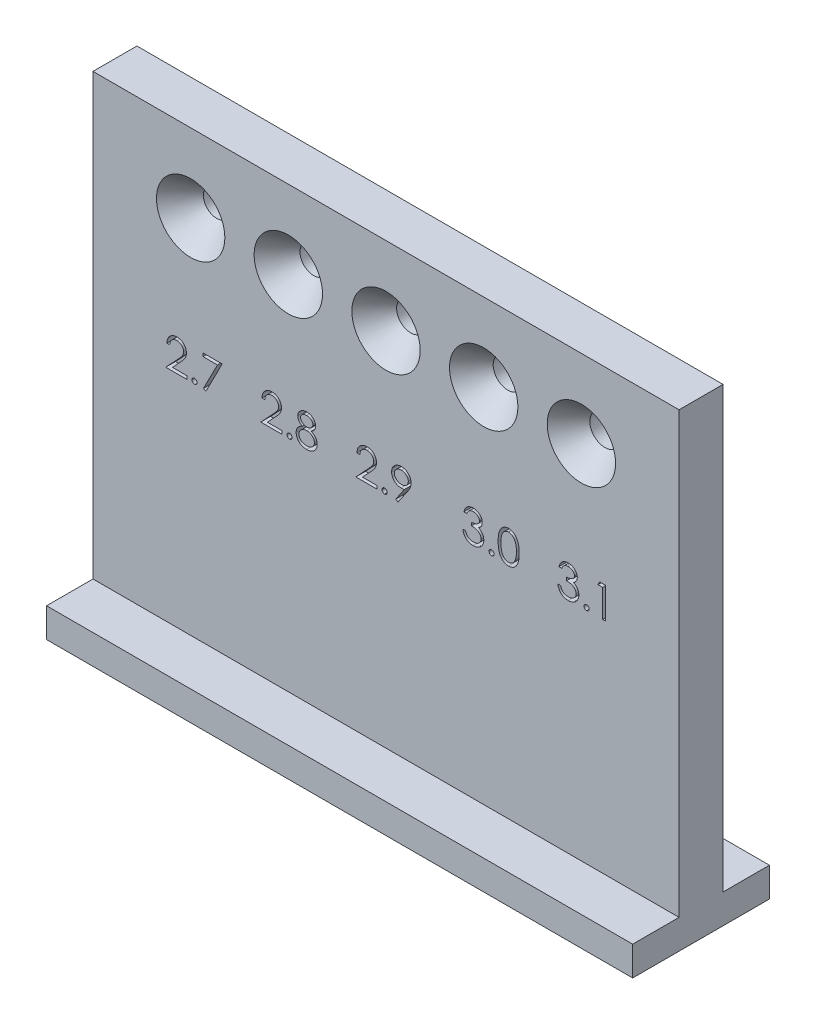
from build123d import *

# Parameters (mm, degrees)
SKETCH1_W                    = 60
SKETCH1_H                    = 14
BOSS_EXTRUDE1_DEPTH          = 3
SKETCH2_W                    = 60
SKETCH2_H                    = 4.5
BOSS_EXTRUDE2_DEPTH          = 45
CUT_EXTRUDE1_REACH           = 59.355
SKETCH3_R                    = 1.35
SKETCH3_R_2                  = 1.4
SKETCH3_R_3                  = 1.45
SKETCH3_R_4                  = 1.5
SKETCH3_R_5                  = 1.55
SKETCH4_R                    = 3.5
CUT_EXTRUDE2_DEPTH           = 2.7
CUT_EXTRUDE2_DRAFT           = -39
CUT_EXTRUDE2_PROFILE_2_DEPTH = 2.7
CUT_EXTRUDE2_PROFILE_2_DRAFT = -39
CUT_EXTRUDE2_PROFILE_3_DEPTH = 2.7
CUT_EXTRUDE2_PROFILE_3_DRAFT = -39
CUT_EXTRUDE2_PROFILE_4_DEPTH = 2.7
CUT_EXTRUDE2_PROFILE_4_DRAFT = -39
CUT_EXTRUDE2_PROFILE_5_DEPTH = 2.7
CUT_EXTRUDE2_PROFILE_5_DRAFT = -39
CUT_EXTRUDE3_DEPTH           = 1


with BuildPart() as part:
    # Sketch1 → Boss-Extrude1 (new body)
    with BuildSketch(Plane(origin=(0, 0, 0), x_dir=(1, 0, 0), z_dir=(0, 1, 0))):
        Rectangle(SKETCH1_W, SKETCH1_H)
    extrude(amount=BOSS_EXTRUDE1_DEPTH)

    # Sketch2 → Boss-Extrude2 (add)
    with BuildSketch(Plane(origin=(0, 3, 0), x_dir=(1, 0, 0), z_dir=(0, 1, 0))):
        Rectangle(SKETCH2_W, SKETCH2_H)
    extrude(amount=BOSS_EXTRUDE2_DEPTH)

    # Sketch3 → Cut-Extrude1 (cut, up to next)
    with BuildSketch(Plane.XY.offset(2.25), mode=Mode.PRIVATE) as cut_extrude1_sk1:
        with Locations((-20, 40)):
            Circle(SKETCH3_R)
    cut_extrude1_tool1 = extrude(cut_extrude1_sk1.sketch, amount=-CUT_EXTRUDE1_REACH, mode=Mode.PRIVATE) & part.part
    # Sketch3 → Cut-Extrude1 (cut, up to next)
    with BuildSketch(Plane.XY.offset(2.25), mode=Mode.PRIVATE) as cut_extrude1_sk2:
        with Locations((-10, 40)):
            Circle(SKETCH3_R_2)
    cut_extrude1_tool2 = extrude(cut_extrude1_sk2.sketch, amount=-CUT_EXTRUDE1_REACH, mode=Mode.PRIVATE) & part.part
    # Sketch3 → Cut-Extrude1 (cut, up to next)
    with BuildSketch(Plane.XY.offset(2.25), mode=Mode.PRIVATE) as cut_extrude1_sk3:
        with Locations((0, 40)):
            Circle(SKETCH3_R_3)
    cut_extrude1_tool3 = extrude(cut_extrude1_sk3.sketch, amount=-CUT_EXTRUDE1_REACH, mode=Mode.PRIVATE) & part.part
    # Sketch3 → Cut-Extrude1 (cut, up to next)
    with BuildSketch(Plane.XY.offset(2.25), mode=Mode.PRIVATE) as cut_extrude1_sk4:
        with Locations((10, 40)):
            Circle(SKETCH3_R_4)
    cut_extrude1_tool4 = extrude(cut_extrude1_sk4.sketch, amount=-CUT_EXTRUDE1_REACH, mode=Mode.PRIVATE) & part.part
    # Sketch3 → Cut-Extrude1 (cut, up to next)
    with BuildSketch(Plane.XY.offset(2.25), mode=Mode.PRIVATE) as cut_extrude1_sk5:
        with Locations((20, 40)):
            Circle(SKETCH3_R_5)
    cut_extrude1_tool5 = extrude(cut_extrude1_sk5.sketch, amount=-CUT_EXTRUDE1_REACH, mode=Mode.PRIVATE) & part.part
    add(cut_extrude1_tool1.solids().sort_by_distance((-20, 40, 2.25))[0], mode=Mode.SUBTRACT)
    add(cut_extrude1_tool2.solids().sort_by_distance((-10, 40, 2.25))[0], mode=Mode.SUBTRACT)
    add(cut_extrude1_tool3.solids().sort_by_distance((0, 40, 2.25))[0], mode=Mode.SUBTRACT)
    add(cut_extrude1_tool4.solids().sort_by_distance((10, 40, 2.25))[0], mode=Mode.SUBTRACT)
    add(cut_extrude1_tool5.solids().sort_by_distance((20, 40, 2.25))[0], mode=Mode.SUBTRACT)


with BuildPart() as cut_extrude2_tool:
    # Sketch4 → Cut-Extrude2 (with draft: the straight prism first)
    with BuildSketch(Plane.XY.offset(2.25)):
        with Locations((-20, 40)):
            Circle(SKETCH4_R)
    extrude(amount=-CUT_EXTRUDE2_DEPTH)
    # Cut-Extrude2: the draft: its side faces are tilted about the plane it starts from
    cut_extrude2_sides = [cut_extrude2_tool.faces().sort_by_distance(p)[0] for p in [
        (-23.5, 40, 0.9),
    ]]
    draft(cut_extrude2_sides, Plane.XY.offset(2.25), CUT_EXTRUDE2_DRAFT)


with BuildPart() as part_1:
    add(part.part)

    # Cut-Extrude2: cut by cut_extrude2_tool
    add(cut_extrude2_tool.part, mode=Mode.SUBTRACT)


with BuildPart() as cut_extrude2_profile_2_tool:
    # Sketch4 → Cut-Extrude2 profile 2 (with draft: the straight prism first)
    with BuildSketch(Plane.XY.offset(2.25)):
        with Locations((-10, 40)):
            Circle(SKETCH4_R)
    extrude(amount=-CUT_EXTRUDE2_PROFILE_2_DEPTH)
    # Cut-Extrude2 profile 2: the draft: its side faces are tilted about the plane it starts from
    cut_extrude2_profile_2_sides = [cut_extrude2_profile_2_tool.faces().sort_by_distance(p)[0] for p in [
        (-13.5, 40, 0.9),
    ]]
    draft(cut_extrude2_profile_2_sides, Plane.XY.offset(2.25), CUT_EXTRUDE2_PROFILE_2_DRAFT)


with BuildPart() as part_2:
    add(part_1.part)

    # Cut-Extrude2 profile 2: cut by cut_extrude2_profile_2_tool
    add(cut_extrude2_profile_2_tool.part, mode=Mode.SUBTRACT)


with BuildPart() as cut_extrude2_profile_3_tool:
    # Sketch4 → Cut-Extrude2 profile 3 (with draft: the straight prism first)
    with BuildSketch(Plane.XY.offset(2.25)):
        with Locations((0, 40)):
            Circle(SKETCH4_R)
    extrude(amount=-CUT_EXTRUDE2_PROFILE_3_DEPTH)
    # Cut-Extrude2 profile 3: the draft: its side faces are tilted about the plane it starts from
    cut_extrude2_profile_3_sides = [cut_extrude2_profile_3_tool.faces().sort_by_distance(p)[0] for p in [
        (-3.5, 40, 0.9),
    ]]
    draft(cut_extrude2_profile_3_sides, Plane.XY.offset(2.25), CUT_EXTRUDE2_PROFILE_3_DRAFT)


with BuildPart() as part_3:
    add(part_2.part)

    # Cut-Extrude2 profile 3: cut by cut_extrude2_profile_3_tool
    add(cut_extrude2_profile_3_tool.part, mode=Mode.SUBTRACT)


with BuildPart() as cut_extrude2_profile_4_tool:
    # Sketch4 → Cut-Extrude2 profile 4 (with draft: the straight prism first)
    with BuildSketch(Plane.XY.offset(2.25)):
        with Locations((10, 40)):
            Circle(SKETCH4_R)
    extrude(amount=-CUT_EXTRUDE2_PROFILE_4_DEPTH)
    # Cut-Extrude2 profile 4: the draft: its side faces are tilted about the plane it starts from
    cut_extrude2_profile_4_sides = [cut_extrude2_profile_4_tool.faces().sort_by_distance(p)[0] for p in [
        (6.5, 40, 0.9),
    ]]
    draft(cut_extrude2_profile_4_sides, Plane.XY.offset(2.25), CUT_EXTRUDE2_PROFILE_4_DRAFT)


with BuildPart() as part_4:
    add(part_3.part)

    # Cut-Extrude2 profile 4: cut by cut_extrude2_profile_4_tool
    add(cut_extrude2_profile_4_tool.part, mode=Mode.SUBTRACT)


with BuildPart() as cut_extrude2_profile_5_tool:
    # Sketch4 → Cut-Extrude2 profile 5 (with draft: the straight prism first)
    with BuildSketch(Plane.XY.offset(2.25)):
        with Locations((20, 40)):
            Circle(SKETCH4_R)
    extrude(amount=-CUT_EXTRUDE2_PROFILE_5_DEPTH)
    # Cut-Extrude2 profile 5: the draft: its side faces are tilted about the plane it starts from
    cut_extrude2_profile_5_sides = [cut_extrude2_profile_5_tool.faces().sort_by_distance(p)[0] for p in [
        (16.5, 40, 0.9),
    ]]
    draft(cut_extrude2_profile_5_sides, Plane.XY.offset(2.25), CUT_EXTRUDE2_PROFILE_5_DRAFT)


with BuildPart() as part_5:
    add(part_4.part)

    # Cut-Extrude2 profile 5: cut by cut_extrude2_profile_5_tool
    add(cut_extrude2_profile_5_tool.part, mode=Mode.SUBTRACT)

    # Sketch5 → Cut-Extrude3 (cut)
    # profile 1 of 15: a face of its own
    with BuildSketch(Plane.XY.offset(2.25)):
        with BuildLine():
            Line((-22.143910256, 27.698076923), (-22.428846154, 27.698076923))
            add(Edge.make_bspline(
                [(-22.428846154, 27.698076923), (-22.426989094, 27.735878371), (-22.423341877, 27.810119409), (-22.406261929, 27.918363239), (-22.381822704, 28.021827235), (-22.347268314, 28.119680657), (-22.304354762, 28.212788718), (-22.252892523, 28.300781589), (-22.191938101, 28.383323596), (-22.122807707, 28.459649547), (-22.047724727, 28.5296697), (-21.966711482, 28.590135528), (-21.881580636, 28.641223701), (-21.792590467, 28.683933113), (-21.698736956, 28.715991402), (-21.600871792, 28.739778175), (-21.498565004, 28.754089574), (-21.428860126, 28.755627894), (-21.393409455, 28.756410256)],
                knots=[0, 0, 0, 0, 1.10065271, 2.161652631, 3.183658789, 4.190468796, 5.17591951, 6.163126047, 7.15150782, 8.156236427, 9.156009102, 10.134482811, 11.092018607, 12.041330605, 13.001268258, 13.972401359, 14.968799086, 16, 16, 16, 16], degree=3))
            add(Edge.make_bspline(
                [(-21.393409455, 28.756410256), (-21.358595059, 28.755595228), (-21.290186015, 28.753993726), (-21.190344045, 28.740240507), (-21.095296071, 28.718699863), (-21.005227883, 28.688478021), (-20.920858095, 28.647852148), (-20.841552905, 28.599050095), (-20.766368169, 28.542607819), (-20.698689159, 28.476156146), (-20.636542544, 28.405215411), (-20.582928355, 28.329479956), (-20.537014986, 28.251257675), (-20.498744733, 28.169952092), (-20.470572379, 28.084797659), (-20.449183576, 27.997034125), (-20.437093707, 27.905753047), (-20.435238216, 27.843970671), (-20.434294872, 27.812560096)],
                knots=[0, 0, 0, 0, 1.111607364, 2.184268762, 3.212621178, 4.221274766, 5.211760367, 6.196651075, 7.1921475, 8.207485113, 9.220403448, 10.201281604, 11.166441695, 12.114753415, 13.065576456, 14.026450734, 14.996634279, 16, 16, 16, 16], degree=3))
            add(Edge.make_bspline(
                [(-20.434294872, 27.812560096), (-20.435830903, 27.768338846), (-20.438876011, 27.680672367), (-20.464924052, 27.551844598), (-20.505606244, 27.427027711), (-20.554589561, 27.326573158), (-20.604003849, 27.245625632), (-20.648533231, 27.178979021), (-20.700662024, 27.10721906), (-20.761148947, 27.030586047), (-20.828742767, 26.948479726), (-20.90405573, 26.860949697), (-20.987624888, 26.768900306), (-21.046279385, 26.706030225), (-21.076672676, 26.673452524)],
                knots=[0, 0, 0, 0, 1.184426356, 2.348067706, 3.509069118, 4.696110526, 5.333549288, 6.050745305, 6.844228056, 7.710549037, 8.667450064, 9.695053472, 10.805634456, 12, 12, 12, 12], degree=3))
            Line((-21.076672676, 26.673452524), (-21.871058694, 25.825641026))
            Line((-21.871058694, 25.825641026), (-20.393589744, 25.825641026))
            Line((-20.393589744, 25.825641026), (-20.393589744, 25.5))
            Line((-20.393589744, 25.5), (-22.550961538, 25.5))
            Line((-22.550961538, 25.5), (-21.31963141, 26.81401242))
            add(Edge.make_bspline(
                [(-21.31963141, 26.81401242), (-21.289652256, 26.845307312), (-21.232068435, 26.905418396), (-21.150622812, 26.993178081), (-21.07747173, 27.074593736), (-21.012141667, 27.149511533), (-20.956049844, 27.219027313), (-20.906272891, 27.280889651), (-20.866389819, 27.337816902), (-20.823105138, 27.403803031), (-20.781182455, 27.48436849), (-20.745157675, 27.582824051), (-20.723191348, 27.68417663), (-20.720556248, 27.752667764), (-20.719230769, 27.787119391)],
                knots=[0, 0, 0, 0, 1.329631726, 2.553950428, 3.673215718, 4.687767853, 5.603093632, 6.413772471, 7.123043292, 7.734684054, 8.834405432, 9.900288307, 10.943827018, 12, 12, 12, 12], degree=3))
            add(Edge.make_bspline(
                [(-20.719230769, 27.787119391), (-20.719807478, 27.808783231), (-20.720944061, 27.8514785), (-20.730974972, 27.914076581), (-20.746133789, 27.974460376), (-20.767855559, 28.032815624), (-20.796527387, 28.088555608), (-20.831428239, 28.141748179), (-20.871696368, 28.193173169), (-20.918279305, 28.241390804), (-20.969452612, 28.285551612), (-21.02351311, 28.324671318), (-21.080708562, 28.35736394), (-21.140797815, 28.384164112), (-21.203613348, 28.405187494), (-21.269276653, 28.419754919), (-21.337606296, 28.428901173), (-21.384263824, 28.430138671), (-21.408037861, 28.430769231)],
                knots=[0, 0, 0, 0, 0.991446411, 1.95395049, 2.89581595, 3.838931463, 4.798493298, 5.75982156, 6.748411868, 7.785213223, 8.824556874, 9.840280684, 10.836137867, 11.835679398, 12.848801643, 13.863922112, 14.911575587, 16, 16, 16, 16], degree=3))
            add(Edge.make_bspline(
                [(-21.408037861, 28.430769231), (-21.432867116, 28.430120594), (-21.481627674, 28.42884678), (-21.553218511, 28.41993622), (-21.621513466, 28.404563922), (-21.686684335, 28.383539367), (-21.748841388, 28.356816255), (-21.807682343, 28.323531601), (-21.863075106, 28.283813718), (-21.91512381, 28.238782642), (-21.963078991, 28.188647032), (-22.005212942, 28.132757994), (-22.042028441, 28.072135982), (-22.074149674, 28.006944568), (-22.100235193, 27.936592211), (-22.120167979, 27.86132865), (-22.135940333, 27.781480682), (-22.141209491, 27.726339927), (-22.143910256, 27.698076923)],
                knots=[0, 0, 0, 0, 1.031018746, 2.02475058, 2.990194455, 3.934040569, 4.864654155, 5.795059489, 6.735614925, 7.690564532, 8.649604399, 9.611025574, 10.590972636, 11.591080095, 12.624614302, 13.701020113, 14.821632451, 16, 16, 16, 16], degree=3))
        make_face()
    # profile 2 of 15: a face of its own
    with BuildSketch(Plane.XY.offset(2.25)):
        with BuildLine():
            add(Edge.make_bspline(
                [(-19.599839744, 25.988461538), (-19.582159337, 25.987410916), (-19.547498966, 25.985351293), (-19.497389186, 25.971221025), (-19.452036887, 25.946130668), (-19.411639779, 25.912690862), (-19.378341761, 25.872145511), (-19.352357242, 25.827154936), (-19.338350063, 25.776625635), (-19.336305443, 25.741764429), (-19.33525641, 25.723878205)],
                knots=[0, 0, 0, 0, 1.020151414, 1.999887582, 2.974338812, 3.990962822, 5.007586832, 5.987933904, 6.967670073, 8, 8, 8, 8], degree=3))
            add(Edge.make_bspline(
                [(-19.33525641, 25.723878205), (-19.336340991, 25.706421756), (-19.338479768, 25.671997895), (-19.352325134, 25.621849711), (-19.378539794, 25.576831019), (-19.411410109, 25.535735508), (-19.452046874, 25.502224861), (-19.497496406, 25.47734797), (-19.547381333, 25.462205959), (-19.582139712, 25.460277104), (-19.599839744, 25.459294872)],
                knots=[0, 0, 0, 0, 1.009421747, 1.99056486, 2.972319754, 3.999869655, 5.017953583, 5.993804169, 6.978383603, 8, 8, 8, 8], degree=3))
            add(Edge.make_bspline(
                [(-19.599839744, 25.459294872), (-19.617552529, 25.460241564), (-19.652132527, 25.462089754), (-19.701831251, 25.477658871), (-19.747557572, 25.501991581), (-19.788186425, 25.535797992), (-19.821332038, 25.576619551), (-19.846392207, 25.622159752), (-19.861441842, 25.671854341), (-19.863421112, 25.706393482), (-19.864423077, 25.723878205)],
                knots=[0, 0, 0, 0, 1.022052826, 1.995314843, 2.982371812, 4.00089066, 5.028879526, 6.005146991, 6.990147033, 8, 8, 8, 8], degree=3))
            add(Edge.make_bspline(
                [(-19.864423077, 25.723878205), (-19.863459601, 25.741793714), (-19.861578533, 25.776771546), (-19.846360613, 25.826845022), (-19.821526478, 25.872354963), (-19.787957298, 25.912629004), (-19.747567401, 25.9463632), (-19.701941558, 25.970914834), (-19.652012832, 25.985465779), (-19.617532388, 25.987445633), (-19.599839744, 25.988461538)],
                knots=[0, 0, 0, 0, 1.032775665, 2.016367738, 2.991239715, 4.008302682, 5.025365648, 6.011011707, 6.979408107, 8, 8, 8, 8], degree=3))
        make_face()
    # profile 3 of 15: a face of its own
    with BuildSketch(Plane.XY.offset(2.25)):
        Polygon((-18.724679487, 28.675), (-16.770833333, 28.675), (-18.43974359, 25.418589744), (-18.685882412, 25.554061498), (-17.252934696, 28.349358974), (-18.724679487, 28.349358974), align=None)
    # profile 4 of 15: a face of its own
    with BuildSketch(Plane.XY.offset(2.25)):
        with BuildLine():
            Line((-12.415384615, 27.698076923), (-12.700320513, 27.698076923))
            add(Edge.make_bspline(
                [(-12.700320513, 27.698076923), (-12.698463453, 27.735878371), (-12.694816236, 27.810119409), (-12.677736288, 27.918363239), (-12.653297063, 28.021827235), (-12.618742673, 28.119680657), (-12.575829121, 28.212788718), (-12.524366882, 28.300781589), (-12.46341246, 28.383323596), (-12.394282066, 28.459649547), (-12.319199086, 28.5296697), (-12.238185841, 28.590135528), (-12.153054995, 28.641223701), (-12.064064826, 28.683933113), (-11.970211314, 28.715991402), (-11.872346151, 28.739778175), (-11.770039363, 28.754089574), (-11.700334485, 28.755627894), (-11.664883814, 28.756410256)],
                knots=[0, 0, 0, 0, 1.10065271, 2.161652631, 3.183658789, 4.190468796, 5.17591951, 6.163126047, 7.15150782, 8.156236427, 9.156009102, 10.134482811, 11.092018607, 12.041330605, 13.001268258, 13.972401359, 14.968799086, 16, 16, 16, 16], degree=3))
            add(Edge.make_bspline(
                [(-11.664883814, 28.756410256), (-11.630069418, 28.755595228), (-11.561660374, 28.753993726), (-11.461818404, 28.740240507), (-11.36677043, 28.718699863), (-11.276702242, 28.688478021), (-11.192332454, 28.647852148), (-11.113027264, 28.599050095), (-11.037842528, 28.542607819), (-10.970163518, 28.476156146), (-10.908016903, 28.405215411), (-10.854402714, 28.329479956), (-10.808489345, 28.251257675), (-10.770219092, 28.169952092), (-10.742046737, 28.084797659), (-10.720657934, 27.997034125), (-10.708568066, 27.905753047), (-10.706712575, 27.843970671), (-10.705769231, 27.812560096)],
                knots=[0, 0, 0, 0, 1.111607364, 2.184268762, 3.212621178, 4.221274766, 5.211760367, 6.196651075, 7.1921475, 8.207485113, 9.220403448, 10.201281604, 11.166441695, 12.114753415, 13.065576456, 14.026450734, 14.996634279, 16, 16, 16, 16], degree=3))
            add(Edge.make_bspline(
                [(-10.705769231, 27.812560096), (-10.707305262, 27.768338846), (-10.71035037, 27.680672367), (-10.736398411, 27.551844598), (-10.777080603, 27.427027711), (-10.82606392, 27.326573158), (-10.875478208, 27.245625632), (-10.92000759, 27.178979021), (-10.972136383, 27.10721906), (-11.032623306, 27.030586047), (-11.100217126, 26.948479726), (-11.175530089, 26.860949697), (-11.259099247, 26.768900306), (-11.317753744, 26.706030225), (-11.348147035, 26.673452524)],
                knots=[0, 0, 0, 0, 1.184426356, 2.348067706, 3.509069118, 4.696110526, 5.333549288, 6.050745305, 6.844228056, 7.710549037, 8.667450064, 9.695053472, 10.805634456, 12, 12, 12, 12], degree=3))
            Line((-11.348147035, 26.673452524), (-12.142533053, 25.825641026))
            Line((-12.142533053, 25.825641026), (-10.665064103, 25.825641026))
            Line((-10.665064103, 25.825641026), (-10.665064103, 25.5))
            Line((-10.665064103, 25.5), (-12.822435897, 25.5))
            Line((-12.822435897, 25.5), (-11.591105769, 26.81401242))
            add(Edge.make_bspline(
                [(-11.591105769, 26.81401242), (-11.561126615, 26.845307312), (-11.503542794, 26.905418396), (-11.422097171, 26.993178081), (-11.348946089, 27.074593736), (-11.283616026, 27.149511533), (-11.227524203, 27.219027313), (-11.17774725, 27.280889651), (-11.137864178, 27.337816902), (-11.094579497, 27.403803031), (-11.052656814, 27.48436849), (-11.016632034, 27.582824051), (-10.994665707, 27.68417663), (-10.992030606, 27.752667764), (-10.990705128, 27.787119391)],
                knots=[0, 0, 0, 0, 1.329631726, 2.553950428, 3.673215718, 4.687767853, 5.603093632, 6.413772471, 7.123043292, 7.734684054, 8.834405432, 9.900288307, 10.943827018, 12, 12, 12, 12], degree=3))
            add(Edge.make_bspline(
                [(-10.990705128, 27.787119391), (-10.991281837, 27.808783231), (-10.99241842, 27.8514785), (-11.002449331, 27.914076581), (-11.017608148, 27.974460376), (-11.039329917, 28.032815624), (-11.068001746, 28.088555608), (-11.102902598, 28.141748179), (-11.143170727, 28.193173169), (-11.189753664, 28.241390804), (-11.240926971, 28.285551612), (-11.294987469, 28.324671318), (-11.352182921, 28.35736394), (-11.412272174, 28.384164112), (-11.475087707, 28.405187494), (-11.540751012, 28.419754919), (-11.609080655, 28.428901173), (-11.655738183, 28.430138671), (-11.67951222, 28.430769231)],
                knots=[0, 0, 0, 0, 0.991446411, 1.95395049, 2.89581595, 3.838931463, 4.798493298, 5.75982156, 6.748411868, 7.785213223, 8.824556874, 9.840280684, 10.836137867, 11.835679398, 12.848801643, 13.863922112, 14.911575587, 16, 16, 16, 16], degree=3))
            add(Edge.make_bspline(
                [(-11.67951222, 28.430769231), (-11.704341475, 28.430120594), (-11.753102033, 28.42884678), (-11.82469287, 28.41993622), (-11.892987825, 28.404563922), (-11.958158694, 28.383539367), (-12.020315747, 28.356816255), (-12.079156702, 28.323531601), (-12.134549465, 28.283813718), (-12.186598169, 28.238782642), (-12.23455335, 28.188647032), (-12.276687301, 28.132757994), (-12.3135028, 28.072135982), (-12.345624033, 28.006944568), (-12.371709552, 27.936592211), (-12.391642338, 27.86132865), (-12.407414692, 27.781480682), (-12.41268385, 27.726339927), (-12.415384615, 27.698076923)],
                knots=[0, 0, 0, 0, 1.031018746, 2.02475058, 2.990194455, 3.934040569, 4.864654155, 5.795059489, 6.735614925, 7.690564532, 8.649604399, 9.611025574, 10.590972636, 11.591080095, 12.624614302, 13.701020113, 14.821632451, 16, 16, 16, 16], degree=3))
        make_face()
    # profile 5 of 15: a face of its own
    with BuildSketch(Plane.XY.offset(2.25)):
        with BuildLine():
            add(Edge.make_bspline(
                [(-9.871314103, 25.988461538), (-9.853633696, 25.987410916), (-9.818973325, 25.985351293), (-9.768863545, 25.971221025), (-9.723511246, 25.946130668), (-9.683114138, 25.912690862), (-9.64981612, 25.872145511), (-9.623831601, 25.827154936), (-9.609824422, 25.776625635), (-9.607779802, 25.741764429), (-9.606730769, 25.723878205)],
                knots=[0, 0, 0, 0, 1.020151414, 1.999887582, 2.974338812, 3.990962822, 5.007586832, 5.987933904, 6.967670073, 8, 8, 8, 8], degree=3))
            add(Edge.make_bspline(
                [(-9.606730769, 25.723878205), (-9.60781535, 25.706421756), (-9.609954127, 25.671997895), (-9.623799493, 25.621849711), (-9.650014153, 25.576831019), (-9.682884468, 25.535735508), (-9.723521233, 25.502224861), (-9.768970765, 25.47734797), (-9.818855692, 25.462205959), (-9.853614071, 25.460277104), (-9.871314103, 25.459294872)],
                knots=[0, 0, 0, 0, 1.009421747, 1.99056486, 2.972319754, 3.999869655, 5.017953583, 5.993804169, 6.978383603, 8, 8, 8, 8], degree=3))
            add(Edge.make_bspline(
                [(-9.871314103, 25.459294872), (-9.889026888, 25.460241564), (-9.923606886, 25.462089754), (-9.97330561, 25.477658871), (-10.019031931, 25.501991581), (-10.059660784, 25.535797992), (-10.092806397, 25.576619551), (-10.117866566, 25.622159752), (-10.132916201, 25.671854341), (-10.134895471, 25.706393482), (-10.135897436, 25.723878205)],
                knots=[0, 0, 0, 0, 1.022052826, 1.995314843, 2.982371812, 4.00089066, 5.028879526, 6.005146991, 6.990147033, 8, 8, 8, 8], degree=3))
            add(Edge.make_bspline(
                [(-10.135897436, 25.723878205), (-10.13493396, 25.741793714), (-10.133052892, 25.776771546), (-10.117834972, 25.826845022), (-10.093000837, 25.872354963), (-10.059431657, 25.912629004), (-10.01904176, 25.9463632), (-9.973415917, 25.970914834), (-9.923487191, 25.985465779), (-9.889006747, 25.987445633), (-9.871314103, 25.988461538)],
                knots=[0, 0, 0, 0, 1.032775665, 2.016367738, 2.991239715, 4.008302682, 5.025365648, 6.011011707, 6.979408107, 8, 8, 8, 8], degree=3))
        make_face()
    # profile 6 of 15: a face of its own
    with BuildSketch(Plane.XY.offset(2.25)):
        with BuildLine():
            add(Edge.make_bspline(
                [(-7.656064704, 27.268765024), (-7.630076379, 27.255214164), (-7.579390466, 27.228785461), (-7.50720257, 27.186230639), (-7.441230604, 27.141380621), (-7.379644166, 27.096353806), (-7.323525269, 27.049425808), (-7.273501409, 27.000410016), (-7.228336925, 26.950529908), (-7.188942628, 26.898940839), (-7.154292641, 26.845779865), (-7.124345918, 26.790907453), (-7.098748884, 26.734443857), (-7.078462504, 26.675772733), (-7.061751307, 26.615755924), (-7.050252723, 26.553618469), (-7.044068804, 26.489769817), (-7.042899667, 26.446618572), (-7.042307692, 26.424769631)],
                knots=[0, 0, 0, 0, 1.272397273, 2.481599622, 3.635517121, 4.734568067, 5.792894095, 6.808321871, 7.773003508, 8.711915296, 9.623354172, 10.525449501, 11.423591555, 12.311487226, 13.218079475, 14.126165749, 15.051214107, 16, 16, 16, 16], degree=3))
            add(Edge.make_bspline(
                [(-7.042307692, 26.424769631), (-7.043007481, 26.394200974), (-7.044392625, 26.333694131), (-7.056457611, 26.244389444), (-7.074521527, 26.157655899), (-7.100900799, 26.073512511), (-7.135112232, 25.992423579), (-7.177273362, 25.914319692), (-7.224999241, 25.837920747), (-7.263328058, 25.790913147), (-7.282722356, 25.767127404)],
                knots=[0, 0, 0, 0, 1.025265484, 2.029385089, 3.018602448, 3.995076438, 4.983346944, 5.966715145, 6.97116228, 8, 8, 8, 8], degree=3))
            add(Edge.make_bspline(
                [(-7.282722356, 25.767127404), (-7.307974015, 25.73937448), (-7.358165291, 25.684211583), (-7.444146946, 25.61259192), (-7.538509655, 25.552403541), (-7.640888285, 25.503352608), (-7.75100917, 25.465174722), (-7.868848846, 25.437740438), (-7.994637042, 25.42202652), (-8.081092719, 25.419755043), (-8.125445713, 25.418589744)],
                knots=[0, 0, 0, 0, 0.954267603, 1.896743057, 2.838368354, 3.796610408, 4.779680527, 5.799409237, 6.871065594, 8, 8, 8, 8], degree=3))
            add(Edge.make_bspline(
                [(-8.125445713, 25.418589744), (-8.168093573, 25.419635206), (-8.251081976, 25.421669569), (-8.371875193, 25.435453089), (-8.48447255, 25.459608368), (-8.589528735, 25.492668835), (-8.686410407, 25.535676685), (-8.774841506, 25.589205742), (-8.856097895, 25.651101407), (-8.927713625, 25.723141321), (-8.991293856, 25.800300962), (-9.047144875, 25.879904208), (-9.093567075, 25.961958325), (-9.13287094, 26.045239815), (-9.162959075, 26.13091597), (-9.183798152, 26.218545981), (-9.197032744, 26.30797679), (-9.19879363, 26.368330504), (-9.199679487, 26.398692909)],
                knots=[0, 0, 0, 0, 1.256902934, 2.445805442, 3.576955095, 4.645999104, 5.686449165, 6.692658513, 7.68621702, 8.689161843, 9.678783111, 10.630372946, 11.551080876, 12.453998257, 13.34127905, 14.221779781, 15.105423033, 16, 16, 16, 16], degree=3))
            add(Edge.make_bspline(
                [(-9.199679487, 26.398692909), (-9.199155267, 26.420971604), (-9.198119222, 26.46500217), (-9.190948395, 26.530052775), (-9.179420005, 26.59336784), (-9.163763212, 26.655181229), (-9.142544209, 26.715042927), (-9.11692456, 26.773236571), (-9.087050575, 26.82982786), (-9.052505518, 26.885126274), (-9.012317253, 26.938356974), (-8.966811657, 26.990423341), (-8.915079233, 27.040517463), (-8.857695499, 27.089251377), (-8.795316239, 27.137489582), (-8.726321193, 27.182625136), (-8.652539393, 27.227853432), (-8.600101632, 27.254893842), (-8.573202123, 27.268765024)],
                knots=[0, 0, 0, 0, 0.941657376, 1.861047343, 2.762797495, 3.66048619, 4.553285746, 5.444104102, 6.34607688, 7.256116206, 8.197091036, 9.162375105, 10.176350973, 11.237807142, 12.343728897, 13.50695164, 14.721116704, 16, 16, 16, 16], degree=3))
            add(Edge.make_bspline(
                [(-8.573202123, 27.268765024), (-8.610024299, 27.288844421), (-8.681322337, 27.327723755), (-8.775728188, 27.399158357), (-8.856818253, 27.476526589), (-8.922363604, 27.561462189), (-8.97395484, 27.651311853), (-9.009350288, 27.745513425), (-9.03329567, 27.842320185), (-9.035667692, 27.908456521), (-9.036858974, 27.941671675)],
                knots=[0, 0, 0, 0, 1.166880483, 2.259407225, 3.286803203, 4.280235371, 5.237608625, 6.161067461, 7.076446754, 8, 8, 8, 8], degree=3))
            add(Edge.make_bspline(
                [(-9.036858974, 27.941671675), (-9.035375411, 27.975505888), (-9.03239319, 28.043518558), (-9.008278321, 28.144761256), (-8.968980832, 28.24419914), (-8.91553107, 28.341350251), (-8.848958381, 28.432926517), (-8.769087586, 28.51506009), (-8.677826024, 28.587006935), (-8.575629245, 28.647401034), (-8.465650659, 28.696553353), (-8.349612824, 28.730460922), (-8.229537505, 28.752627971), (-8.147806003, 28.755137722), (-8.106365184, 28.756410256)],
                knots=[0, 0, 0, 0, 0.888701115, 1.786444228, 2.72001202, 3.692817113, 4.693886446, 5.687152267, 6.695133018, 7.739871481, 8.800368666, 9.853104506, 10.91144658, 12, 12, 12, 12], degree=3))
            add(Edge.make_bspline(
                [(-8.106365184, 28.756410256), (-8.065993866, 28.755098217), (-7.986386227, 28.752511024), (-7.869369672, 28.730932927), (-7.757405676, 28.694892577), (-7.650880345, 28.646000096), (-7.551700722, 28.585777657), (-7.464068627, 28.512842578), (-7.386659785, 28.431071314), (-7.322629656, 28.339522817), (-7.269867606, 28.242745013), (-7.233127503, 28.14148744), (-7.209585355, 28.037937937), (-7.206615946, 27.967872033), (-7.205128205, 27.932767428)],
                knots=[0, 0, 0, 0, 1.072916533, 2.115669174, 3.151510826, 4.193348718, 5.225979165, 6.227137561, 7.216255879, 8.211077061, 9.189680878, 10.138522389, 11.067357538, 12, 12, 12, 12], degree=3))
            add(Edge.make_bspline(
                [(-7.205128205, 27.932767428), (-7.206429557, 27.898317169), (-7.208985337, 27.830658817), (-7.230484568, 27.732028331), (-7.266691645, 27.639661195), (-7.316125636, 27.552509303), (-7.380555899, 27.47215323), (-7.459122393, 27.397571147), (-7.551198734, 27.328150381), (-7.620378252, 27.288974179), (-7.656064704, 27.268765024)],
                knots=[0, 0, 0, 0, 0.975232327, 1.915300861, 2.843280834, 3.77672583, 4.742871857, 5.749627742, 6.839139064, 8, 8, 8, 8], degree=3))
        make_face()
        with BuildLine():
            add(Edge.make_bspline(
                [(-8.122265625, 28.430769231), (-8.144536713, 28.430178281), (-8.1881087, 28.429022125), (-8.251997566, 28.42298179), (-8.31275107, 28.411231372), (-8.371003975, 28.395593398), (-8.425957612, 28.374467866), (-8.478358315, 28.349616679), (-8.527314266, 28.31940332), (-8.573416448, 28.285511376), (-8.614918936, 28.24823424), (-8.651753065, 28.20939608), (-8.682349283, 28.168234118), (-8.708330861, 28.125772248), (-8.727182666, 28.080750226), (-8.741301713, 28.034548373), (-8.750846118, 27.986582846), (-8.751561301, 27.953801868), (-8.751923077, 27.937219551)],
                knots=[0, 0, 0, 0, 1.203892937, 2.355340988, 3.463153438, 4.544400666, 5.610487187, 6.640501085, 7.674077295, 8.714426146, 9.728707835, 10.68524104, 11.601827946, 12.495867327, 13.368432065, 14.231010473, 15.105153427, 16, 16, 16, 16], degree=3))
            add(Edge.make_bspline(
                [(-8.751923077, 27.937219551), (-8.751299537, 27.920636518), (-8.750067332, 27.887866061), (-8.740537681, 27.83947374), (-8.726334677, 27.791919826), (-8.703973005, 27.746335071), (-8.677152094, 27.701138167), (-8.644049112, 27.657458707), (-8.604598351, 27.615144679), (-8.560123459, 27.574555986), (-8.511671564, 27.536547822), (-8.460341753, 27.50355215), (-8.406778241, 27.475944064), (-8.351531364, 27.452966676), (-8.294038058, 27.43510509), (-8.234650615, 27.422433532), (-8.173359052, 27.414557721), (-8.131829525, 27.413616994), (-8.110817308, 27.413141026)],
                knots=[0, 0, 0, 0, 0.873023192, 1.725219244, 2.590779336, 3.480155217, 4.391973325, 5.357036234, 6.360879153, 7.436073238, 8.526419356, 9.601555421, 10.645666583, 11.697338044, 12.750135903, 13.812665442, 14.89329948, 16, 16, 16, 16], degree=3))
            add(Edge.make_bspline(
                [(-8.110817308, 27.413141026), (-8.083829714, 27.413932841), (-8.03012108, 27.415508651), (-7.950946258, 27.430160072), (-7.873963716, 27.453206869), (-7.799996281, 27.484739124), (-7.73095855, 27.524315826), (-7.669417917, 27.571698635), (-7.615899307, 27.625793466), (-7.570958897, 27.685758181), (-7.536115679, 27.749577122), (-7.508990467, 27.813621673), (-7.493150651, 27.878575126), (-7.491084572, 27.922088014), (-7.490064103, 27.943579728)],
                knots=[0, 0, 0, 0, 1.076279235, 2.141928126, 3.20205304, 4.278698113, 5.344010996, 6.36967002, 7.368914609, 8.37248503, 9.349703398, 10.264243087, 11.142681841, 12, 12, 12, 12], degree=3))
            add(Edge.make_bspline(
                [(-7.490064103, 27.943579728), (-7.49054661, 27.958663732), (-7.491504317, 27.988603317), (-7.499396511, 28.032815977), (-7.512437445, 28.076022814), (-7.530093239, 28.11858076), (-7.553324981, 28.159892709), (-7.580869637, 28.200608082), (-7.614329149, 28.239810953), (-7.651881628, 28.278414915), (-7.69446782, 28.314141851), (-7.742005655, 28.345560481), (-7.794251414, 28.37224169), (-7.851206333, 28.393912204), (-7.912660657, 28.410188478), (-7.978331336, 28.422377165), (-8.048765941, 28.429247059), (-8.097234358, 28.430250835), (-8.122265625, 28.430769231)],
                knots=[0, 0, 0, 0, 0.814439003, 1.616544685, 2.417341072, 3.248991801, 4.09997495, 4.973547432, 5.9003056, 6.880240646, 7.880314356, 8.896779544, 9.951930927, 11.043077905, 12.18215768, 13.381699519, 14.647792085, 16, 16, 16, 16], degree=3))
        make_face(mode=Mode.SUBTRACT)
        with BuildLine():
            add(Edge.make_bspline(
                [(-8.103821114, 27.0875), (-8.132056648, 27.086997768), (-8.187447876, 27.086012512), (-8.268598089, 27.075045608), (-8.346479175, 27.059778944), (-8.420828546, 27.036618826), (-8.491614805, 27.006504867), (-8.559221153, 26.970278535), (-8.623130392, 26.927456454), (-8.682460008, 26.878582667), (-8.7366376, 26.825914448), (-8.784170343, 26.770159511), (-8.824535951, 26.712354071), (-8.857041829, 26.651763977), (-8.883722472, 26.589672216), (-8.901242917, 26.524532469), (-8.912474899, 26.457597016), (-8.913983143, 26.412094641), (-8.91474359, 26.389152644)],
                knots=[0, 0, 0, 0, 1.140299081, 2.23698856, 3.303958914, 4.344563908, 5.37730929, 6.408454204, 7.439741482, 8.480804886, 9.510774543, 10.48932336, 11.43758569, 12.353841022, 13.263987381, 14.161954604, 15.073269652, 16, 16, 16, 16], degree=3))
            add(Edge.make_bspline(
                [(-8.91474359, 26.389152644), (-8.913506919, 26.360640322), (-8.911053394, 26.304072542), (-8.891589157, 26.22046747), (-8.860351207, 26.139531227), (-8.816785476, 26.061923384), (-8.762839892, 25.989397217), (-8.696503739, 25.926179542), (-8.62189955, 25.870007915), (-8.536503069, 25.824577716), (-8.44322296, 25.788296669), (-8.342084034, 25.763299475), (-8.234537787, 25.746751874), (-8.160279442, 25.745084381), (-8.122265625, 25.744230769)],
                knots=[0, 0, 0, 0, 0.898778495, 1.783155532, 2.693654817, 3.627872908, 4.583023416, 5.533784346, 6.509005473, 7.520592997, 8.575161974, 9.658835044, 10.801527049, 12, 12, 12, 12], degree=3))
            add(Edge.make_bspline(
                [(-8.122265625, 25.744230769), (-8.092556363, 25.744801188), (-8.034673193, 25.745912548), (-7.950230939, 25.755722657), (-7.870543384, 25.771279817), (-7.79576506, 25.793907176), (-7.725058862, 25.821529655), (-7.659623605, 25.857064329), (-7.597775942, 25.897479651), (-7.542563487, 25.94542955), (-7.492277648, 25.99666452), (-7.448432447, 26.050902631), (-7.410370954, 26.106669811), (-7.380497873, 26.165226322), (-7.3566162, 26.225448738), (-7.339449832, 26.28789238), (-7.328857837, 26.35274877), (-7.327786596, 26.396744356), (-7.32724359, 26.419045473)],
                knots=[0, 0, 0, 0, 1.224942928, 2.386581632, 3.501229538, 4.569074225, 5.605009692, 6.626002462, 7.634866581, 8.645888296, 9.63523824, 10.59253846, 11.518950513, 12.414518923, 13.29783783, 14.186679152, 15.080837789, 16, 16, 16, 16], degree=3))
            add(Edge.make_bspline(
                [(-7.32724359, 26.419045473), (-7.328065324, 26.440705632), (-7.32968564, 26.483415682), (-7.339969638, 26.546703888), (-7.358036184, 26.607847869), (-7.382826037, 26.667583232), (-7.415828767, 26.724699623), (-7.454695185, 26.780685007), (-7.501589136, 26.833985496), (-7.554577705, 26.88501509), (-7.612325476, 26.932200794), (-7.673709244, 26.973942463), (-7.738256506, 27.009096169), (-7.805830675, 27.037686133), (-7.876281708, 27.060171909), (-7.949557786, 27.07587999), (-8.0257447, 27.085767487), (-8.077501619, 27.086915971), (-8.103821114, 27.0875)],
                knots=[0, 0, 0, 0, 0.917430815, 1.809013306, 2.70690318, 3.612392954, 4.541220862, 5.495268465, 6.494511384, 7.542276156, 8.608045339, 9.649016899, 10.681629292, 11.715607085, 12.752076957, 13.808767841, 14.885711793, 16, 16, 16, 16], degree=3))
        make_face(mode=Mode.SUBTRACT)
    # profile 7 of 15: a face of its own
    with BuildSketch(Plane.XY.offset(2.25)):
        with BuildLine():
            Line((-2.686858974, 27.698076923), (-2.971794872, 27.698076923))
            add(Edge.make_bspline(
                [(-2.971794872, 27.698076923), (-2.969937812, 27.735878371), (-2.966290595, 27.810119409), (-2.949210647, 27.918363239), (-2.924771422, 28.021827235), (-2.890217032, 28.119680657), (-2.84730348, 28.212788718), (-2.795841241, 28.300781589), (-2.734886819, 28.383323596), (-2.665756425, 28.459649547), (-2.590673445, 28.5296697), (-2.5096602, 28.590135528), (-2.424529354, 28.641223701), (-2.335539185, 28.683933113), (-2.241685673, 28.715991402), (-2.14382051, 28.739778175), (-2.041513722, 28.754089574), (-1.971808844, 28.755627894), (-1.936358173, 28.756410256)],
                knots=[0, 0, 0, 0, 1.10065271, 2.161652631, 3.183658789, 4.190468796, 5.17591951, 6.163126047, 7.15150782, 8.156236427, 9.156009102, 10.134482811, 11.092018607, 12.041330605, 13.001268258, 13.972401359, 14.968799086, 16, 16, 16, 16], degree=3))
            add(Edge.make_bspline(
                [(-1.936358173, 28.756410256), (-1.901543777, 28.755595228), (-1.833134733, 28.753993726), (-1.733292763, 28.740240507), (-1.638244789, 28.718699863), (-1.5481766, 28.688478021), (-1.463806813, 28.647852148), (-1.384501623, 28.599050095), (-1.309316887, 28.542607819), (-1.241637877, 28.476156146), (-1.179491262, 28.405215411), (-1.125877073, 28.329479956), (-1.079963704, 28.251257675), (-1.041693451, 28.169952092), (-1.013521096, 28.084797659), (-0.992132293, 27.997034125), (-0.980042425, 27.905753047), (-0.978186934, 27.843970671), (-0.97724359, 27.812560096)],
                knots=[0, 0, 0, 0, 1.111607364, 2.184268762, 3.212621178, 4.221274766, 5.211760367, 6.196651075, 7.1921475, 8.207485113, 9.220403448, 10.201281604, 11.166441695, 12.114753415, 13.065576456, 14.026450734, 14.996634279, 16, 16, 16, 16], degree=3))
            add(Edge.make_bspline(
                [(-0.97724359, 27.812560096), (-0.978779621, 27.768338846), (-0.981824728, 27.680672367), (-1.00787277, 27.551844598), (-1.048554962, 27.427027711), (-1.097538279, 27.326573158), (-1.146952567, 27.245625632), (-1.191481949, 27.178979021), (-1.243610742, 27.10721906), (-1.304097665, 27.030586047), (-1.371691485, 26.948479726), (-1.447004448, 26.860949697), (-1.530573606, 26.768900306), (-1.589228103, 26.706030225), (-1.619621394, 26.673452524)],
                knots=[0, 0, 0, 0, 1.184426356, 2.348067706, 3.509069118, 4.696110526, 5.333549288, 6.050745305, 6.844228056, 7.710549037, 8.667450064, 9.695053472, 10.805634456, 12, 12, 12, 12], degree=3))
            Line((-1.619621394, 26.673452524), (-2.414007412, 25.825641026))
            Line((-2.414007412, 25.825641026), (-0.936538462, 25.825641026))
            Line((-0.936538462, 25.825641026), (-0.936538462, 25.5))
            Line((-0.936538462, 25.5), (-3.093910256, 25.5))
            Line((-3.093910256, 25.5), (-1.862580128, 26.81401242))
            add(Edge.make_bspline(
                [(-1.862580128, 26.81401242), (-1.832600974, 26.845307312), (-1.775017153, 26.905418396), (-1.69357153, 26.993178081), (-1.620420448, 27.074593736), (-1.555090384, 27.149511533), (-1.498998562, 27.219027313), (-1.449221608, 27.280889651), (-1.409338537, 27.337816902), (-1.366053856, 27.403803031), (-1.324131173, 27.48436849), (-1.288106393, 27.582824051), (-1.266140066, 27.68417663), (-1.263504965, 27.752667764), (-1.262179487, 27.787119391)],
                knots=[0, 0, 0, 0, 1.329631726, 2.553950428, 3.673215718, 4.687767853, 5.603093632, 6.413772471, 7.123043292, 7.734684054, 8.834405432, 9.900288307, 10.943827018, 12, 12, 12, 12], degree=3))
            add(Edge.make_bspline(
                [(-1.262179487, 27.787119391), (-1.262756196, 27.808783231), (-1.263892779, 27.8514785), (-1.27392369, 27.914076581), (-1.289082507, 27.974460376), (-1.310804276, 28.032815624), (-1.339476105, 28.088555608), (-1.374376957, 28.141748179), (-1.414645086, 28.193173169), (-1.461228023, 28.241390804), (-1.51240133, 28.285551612), (-1.566461828, 28.324671318), (-1.62365728, 28.35736394), (-1.683746533, 28.384164112), (-1.746562066, 28.405187494), (-1.812225371, 28.419754919), (-1.880555014, 28.428901173), (-1.927212542, 28.430138671), (-1.950986579, 28.430769231)],
                knots=[0, 0, 0, 0, 0.991446411, 1.95395049, 2.89581595, 3.838931463, 4.798493298, 5.75982156, 6.748411868, 7.785213223, 8.824556874, 9.840280684, 10.836137867, 11.835679398, 12.848801643, 13.863922112, 14.911575587, 16, 16, 16, 16], degree=3))
            add(Edge.make_bspline(
                [(-1.950986579, 28.430769231), (-1.975815834, 28.430120594), (-2.024576392, 28.42884678), (-2.096167229, 28.41993622), (-2.164462184, 28.404563922), (-2.229633053, 28.383539367), (-2.291790106, 28.356816255), (-2.35063106, 28.323531601), (-2.406023824, 28.283813718), (-2.458072528, 28.238782642), (-2.506027709, 28.188647032), (-2.54816166, 28.132757994), (-2.584977159, 28.072135982), (-2.617098392, 28.006944568), (-2.643183911, 27.936592211), (-2.663116697, 27.86132865), (-2.678889051, 27.781480682), (-2.684158209, 27.726339927), (-2.686858974, 27.698076923)],
                knots=[0, 0, 0, 0, 1.031018746, 2.02475058, 2.990194455, 3.934040569, 4.864654155, 5.795059489, 6.735614925, 7.690564532, 8.649604399, 9.611025574, 10.590972636, 11.591080095, 12.624614302, 13.701020113, 14.821632451, 16, 16, 16, 16], degree=3))
        make_face()
    # profile 8 of 15: a face of its own
    with BuildSketch(Plane.XY.offset(2.25)):
        with BuildLine():
            add(Edge.make_bspline(
                [(-0.142788462, 25.988461538), (-0.125108055, 25.987410916), (-0.090447684, 25.985351293), (-0.040337904, 25.971221025), (0.005014395, 25.946130668), (0.045411503, 25.912690862), (0.078709521, 25.872145511), (0.10469404, 25.827154936), (0.118701219, 25.776625635), (0.120745839, 25.741764429), (0.121794872, 25.723878205)],
                knots=[0, 0, 0, 0, 1.020151414, 1.999887582, 2.974338812, 3.990962822, 5.007586832, 5.987933904, 6.967670073, 8, 8, 8, 8], degree=3))
            add(Edge.make_bspline(
                [(0.121794872, 25.723878205), (0.120710291, 25.706421756), (0.118571514, 25.671997895), (0.104726148, 25.621849711), (0.078511488, 25.576831019), (0.045641173, 25.535735508), (0.005004408, 25.502224861), (-0.040445124, 25.47734797), (-0.090330051, 25.462205959), (-0.12508843, 25.460277104), (-0.142788462, 25.459294872)],
                knots=[0, 0, 0, 0, 1.009421747, 1.99056486, 2.972319754, 3.999869655, 5.017953583, 5.993804169, 6.978383603, 8, 8, 8, 8], degree=3))
            add(Edge.make_bspline(
                [(-0.142788462, 25.459294872), (-0.160501247, 25.460241564), (-0.195081245, 25.462089754), (-0.244779969, 25.477658871), (-0.29050629, 25.501991581), (-0.331135143, 25.535797992), (-0.364280756, 25.576619551), (-0.389340925, 25.622159752), (-0.40439056, 25.671854341), (-0.40636983, 25.706393482), (-0.407371795, 25.723878205)],
                knots=[0, 0, 0, 0, 1.022052826, 1.995314843, 2.982371812, 4.00089066, 5.028879526, 6.005146991, 6.990147033, 8, 8, 8, 8], degree=3))
            add(Edge.make_bspline(
                [(-0.407371795, 25.723878205), (-0.406408319, 25.741793714), (-0.404527251, 25.776771546), (-0.389309331, 25.826845022), (-0.364475195, 25.872354963), (-0.330906016, 25.912629004), (-0.290516119, 25.9463632), (-0.244890276, 25.970914834), (-0.19496155, 25.985465779), (-0.160481106, 25.987445633), (-0.142788462, 25.988461538)],
                knots=[0, 0, 0, 0, 1.032775665, 2.016367738, 2.991239715, 4.008302682, 5.025365648, 6.011011707, 6.979408107, 8, 8, 8, 8], degree=3))
        make_face()
    # profile 9 of 15: a face of its own
    with BuildSketch(Plane.XY.offset(2.25)):
        with BuildLine():
            Line((1.220833333, 25.418589744), (0.993139022, 25.576958133))
            Line((0.993139022, 25.576958133), (1.87593149, 26.867437901))
            add(Edge.make_bspline(
                [(1.87593149, 26.867437901), (1.819606323, 26.860549907), (1.708698928, 26.846987065), (1.596995986, 26.844495457), (1.542022236, 26.843269231)],
                knots=[0, 0, 0, 0, 1.015715272, 2, 2, 2, 2], degree=3))
            add(Edge.make_bspline(
                [(1.542022236, 26.843269231), (1.508691949, 26.844122922), (1.443267512, 26.845798642), (1.347081656, 26.859080854), (1.254656897, 26.879537041), (1.166238267, 26.910061269), (1.081493431, 26.947996358), (1.000607391, 26.995038078), (0.923689033, 27.0503795), (0.851564454, 27.113727999), (0.785967377, 27.183285947), (0.727526242, 27.256905709), (0.678956787, 27.335442482), (0.63861017, 27.417294181), (0.60801183, 27.503637264), (0.585730099, 27.593489219), (0.572011964, 27.68747978), (0.570379927, 27.751456149), (0.569551282, 27.783939303)],
                knots=[0, 0, 0, 0, 1.060718605, 2.082097864, 3.085795603, 4.069760067, 5.054557537, 6.03741023, 7.043284206, 8.066802108, 9.088538119, 10.083643548, 11.053783639, 12.022749082, 12.983451788, 13.964007469, 14.966251758, 16, 16, 16, 16], degree=3))
            add(Edge.make_bspline(
                [(0.569551282, 27.783939303), (0.571124662, 27.828360866), (0.574212888, 27.915551384), (0.599067257, 28.042944875), (0.639943422, 28.163401239), (0.696937735, 28.276603772), (0.768724233, 28.380924057), (0.855001311, 28.474911867), (0.955244193, 28.557230413), (1.06716931, 28.627991255), (1.18813955, 28.684900859), (1.314838976, 28.72684651), (1.446296785, 28.75151966), (1.535348886, 28.754772549), (1.580183293, 28.756410256)],
                knots=[0, 0, 0, 0, 1.022988612, 2.007919123, 2.978103895, 3.94594894, 4.918897164, 5.887013414, 6.875921846, 7.89917871, 8.930658928, 9.948724884, 10.967259574, 12, 12, 12, 12], degree=3))
            add(Edge.make_bspline(
                [(1.580183293, 28.756410256), (1.624169217, 28.754750037), (1.711081256, 28.7514696), (1.838887712, 28.727444857), (1.961298491, 28.686953018), (2.077635015, 28.630996306), (2.185348625, 28.560855197), (2.282209539, 28.477276022), (2.366007349, 28.380206723), (2.436604727, 28.271995021), (2.493273978, 28.155729259), (2.534160977, 28.03436813), (2.559330236, 27.908784432), (2.562501904, 27.823699445), (2.564102564, 27.780759215)],
                knots=[0, 0, 0, 0, 1.026385292, 2.028040595, 3.023318987, 4.028184125, 5.03290303, 6.015178782, 7.004435299, 8.016004309, 9.023023918, 10.015172535, 10.998308025, 12, 12, 12, 12], degree=3))
            add(Edge.make_bspline(
                [(2.564102564, 27.780759215), (2.563033579, 27.747427369), (2.56086541, 27.679822057), (2.545683188, 27.57710596), (2.51990202, 27.472375202), (2.490645122, 27.383727754), (2.462403799, 27.310513661), (2.435823486, 27.25268187), (2.406330318, 27.191811439), (2.371932581, 27.128540639), (2.334955355, 27.062062911), (2.293173011, 26.993045019), (2.247538671, 26.921394347), (2.215035997, 26.873091631), (2.198392428, 26.848357372)],
                knots=[0, 0, 0, 0, 1.179839688, 2.393009684, 3.667231171, 4.993948276, 5.694988576, 6.444077775, 7.246288328, 8.089075292, 8.993003841, 9.939041771, 10.944649915, 12, 12, 12, 12], degree=3))
            Line((2.198392428, 26.848357372), (1.220833333, 25.418589744))
        make_face()
        with BuildLine():
            add(Edge.make_bspline(
                [(1.594811699, 27.168910256), (1.620061126, 27.169600033), (1.669213177, 27.170942794), (1.741219726, 27.179115463), (1.809186682, 27.193606151), (1.873295601, 27.214397604), (1.934189291, 27.239486153), (1.990900532, 27.271428455), (2.043476786, 27.309543545), (2.092270119, 27.352369774), (2.135598891, 27.399949946), (2.174191497, 27.449749464), (2.206994297, 27.501986932), (2.23290527, 27.557316534), (2.254209135, 27.61439143), (2.268921189, 27.674130738), (2.277071263, 27.736223216), (2.27846062, 27.778404141), (2.279166667, 27.799839744)],
                knots=[0, 0, 0, 0, 1.163407946, 2.26475976, 3.333800367, 4.359385343, 5.366239384, 6.363380779, 7.350133999, 8.353570782, 9.349036268, 10.310270964, 11.253520213, 12.184142, 13.120487599, 14.056272588, 15.012232024, 16, 16, 16, 16], degree=3))
            add(Edge.make_bspline(
                [(2.279166667, 27.799839744), (2.278559181, 27.821284297), (2.277362056, 27.86354342), (2.267757863, 27.925727827), (2.250862125, 27.985320999), (2.228192185, 28.042649189), (2.198328826, 28.097241384), (2.162493522, 28.149782982), (2.119919085, 28.19994084), (2.070931043, 28.246535311), (2.018103984, 28.28948662), (1.961806244, 28.32739256), (1.902501856, 28.359161788), (1.840552626, 28.385377282), (1.775829481, 28.405834965), (1.70837072, 28.420546431), (1.63783546, 28.428685094), (1.589955293, 28.43006567), (1.565554888, 28.430769231)],
                knots=[0, 0, 0, 0, 0.972161553, 1.915763587, 2.844109794, 3.775983486, 4.705125789, 5.659731448, 6.655561913, 7.682237399, 8.721216875, 9.739758359, 10.754845918, 11.767244016, 12.7857855, 13.828538656, 14.893392813, 16, 16, 16, 16], degree=3))
            add(Edge.make_bspline(
                [(1.565554888, 28.430769231), (1.541366692, 28.430064533), (1.49390965, 28.428681923), (1.424001448, 28.420561901), (1.356998817, 28.405736026), (1.292463204, 28.385386758), (1.230515815, 28.359159833), (1.171214224, 28.327390896), (1.114903316, 28.289495345), (1.062126905, 28.246501516), (1.013052361, 28.200157723), (0.971209917, 28.149563255), (0.935292601, 28.097268715), (0.905470277, 28.042641926), (0.882789422, 27.985322938), (0.865896606, 27.925727302), (0.856291628, 27.863543557), (0.85509461, 27.821284343), (0.854487179, 27.799839744)],
                knots=[0, 0, 0, 0, 1.099389452, 2.15699305, 3.192601482, 4.213358962, 5.227959689, 6.245255729, 7.266013209, 8.307253147, 9.336162325, 10.327954924, 11.284637477, 12.215801273, 13.149702402, 14.080068371, 15.025723358, 16, 16, 16, 16], degree=3))
            add(Edge.make_bspline(
                [(0.854487179, 27.799839744), (0.855036841, 27.778387449), (0.856120874, 27.736079598), (0.866578226, 27.67391637), (0.88406638, 27.614327794), (0.907488256, 27.556734467), (0.938332556, 27.501696424), (0.976182046, 27.449474603), (1.020546363, 27.399477016), (1.070832455, 27.352480474), (1.125867144, 27.309343857), (1.18464705, 27.271669868), (1.246160259, 27.239854151), (1.31062331, 27.214325895), (1.377558478, 27.193813886), (1.447567347, 27.17914217), (1.520418391, 27.171021185), (1.569776018, 27.16962065), (1.594811699, 27.168910256)],
                knots=[0, 0, 0, 0, 0.952633368, 1.87876736, 2.791047057, 3.707742249, 4.635551637, 5.587206343, 6.568248508, 7.601284464, 8.641511608, 9.671105535, 10.699146789, 11.713763218, 12.747829548, 13.806491675, 14.887386225, 16, 16, 16, 16], degree=3))
        make_face(mode=Mode.SUBTRACT)
    # profile 10 of 15: a face of its own
    with BuildSketch(Plane.XY.offset(2.25)):
        with BuildLine():
            Line((8.262820513, 27.942307692), (7.977884615, 27.942307692))
            add(Edge.make_bspline(
                [(7.977884615, 27.942307692), (7.985603994, 27.974268588), (8.000694746, 28.036749526), (8.032170402, 28.12601897), (8.066459727, 28.210495307), (8.107634129, 28.288596746), (8.152545641, 28.361892893), (8.204001253, 28.428721313), (8.259627001, 28.490781646), (8.32115392, 28.545857226), (8.385677777, 28.59572988), (8.454107754, 28.638252254), (8.525067093, 28.674832021), (8.599047435, 28.704967517), (8.676269033, 28.727669242), (8.756033763, 28.744140059), (8.838550653, 28.754836284), (8.894564538, 28.75588019), (8.923006811, 28.756410256)],
                knots=[0, 0, 0, 0, 1.162005537, 2.271625781, 3.343758855, 4.383309926, 5.390229558, 6.379919256, 7.361854164, 8.333198761, 9.295911338, 10.242430842, 11.177959212, 12.116337295, 13.062827104, 14.020064771, 14.994644689, 16, 16, 16, 16], degree=3))
            add(Edge.make_bspline(
                [(8.923006811, 28.756410256), (8.964447584, 28.755159098), (9.046425187, 28.752684071), (9.166860237, 28.730083118), (9.282998851, 28.694318891), (9.393569812, 28.644903438), (9.496275104, 28.583954947), (9.587657216, 28.511415507), (9.666477508, 28.428684712), (9.732603122, 28.337305886), (9.7843783, 28.23964696), (9.822556653, 28.139135389), (9.845799178, 28.0360096), (9.848811397, 27.966379783), (9.850320513, 27.931495393)],
                knots=[0, 0, 0, 0, 1.083050992, 2.142477498, 3.193116406, 4.255571735, 5.30263384, 6.308962982, 7.297363603, 8.282367274, 9.249857812, 10.179914175, 11.08814088, 12, 12, 12, 12], degree=3))
            add(Edge.make_bspline(
                [(9.850320513, 27.931495393), (9.84926497, 27.897924943), (9.847199435, 27.832232783), (9.829661002, 27.736328282), (9.800145964, 27.645939116), (9.75926125, 27.560684776), (9.70633713, 27.481105814), (9.642226898, 27.407023185), (9.566478055, 27.338108306), (9.509075018, 27.298629927), (9.479522236, 27.278305288)],
                knots=[0, 0, 0, 0, 1.024540389, 2.004866551, 2.965041327, 3.920577974, 4.882998113, 5.874504559, 6.905732034, 8, 8, 8, 8], degree=3))
            add(Edge.make_bspline(
                [(9.479522236, 27.278305288), (9.513296756, 27.261996519), (9.580213849, 27.229684128), (9.671427544, 27.166314977), (9.754229616, 27.093148148), (9.800406561, 27.03605017), (9.823607772, 27.007361779)],
                knots=[0, 0, 0, 0, 1.015518401, 2.012035669, 3.001164323, 4, 4, 4, 4], degree=3))
            add(Edge.make_bspline(
                [(9.823607772, 27.007361779), (9.838885276, 26.986445104), (9.869190103, 26.94495428), (9.906596623, 26.878246236), (9.940532034, 26.810798814), (9.966975447, 26.74080421), (9.987453169, 26.66907369), (10.002090855, 26.595484088), (10.011184183, 26.519975311), (10.012486434, 26.468891847), (10.013141026, 26.443214143)],
                knots=[0, 0, 0, 0, 1.025084078, 2.033381695, 3.024893161, 4.013698104, 4.991890475, 5.976764909, 6.982997093, 8, 8, 8, 8], degree=3))
            add(Edge.make_bspline(
                [(10.013141026, 26.443214143), (10.011513146, 26.398755324), (10.008265046, 26.310046911), (9.979232779, 26.178987699), (9.934226482, 26.050875994), (9.870311976, 25.928343818), (9.792417878, 25.813698758), (9.699746591, 25.711122392), (9.593351064, 25.622949372), (9.474691654, 25.549280094), (9.346133973, 25.490390265), (9.208633257, 25.449516727), (9.064170708, 25.422895713), (8.965104088, 25.420041054), (8.914738582, 25.418589744)],
                knots=[0, 0, 0, 0, 0.955779014, 1.907060117, 2.875433937, 3.871313158, 4.872415639, 5.851225146, 6.836215519, 7.83643374, 8.849228613, 9.86973379, 10.916971861, 12, 12, 12, 12], degree=3))
            add(Edge.make_bspline(
                [(8.914738582, 25.418589744), (8.880793931, 25.419377337), (8.814002177, 25.420927058), (8.71580986, 25.431521218), (8.622082319, 25.45087058), (8.532692827, 25.476908578), (8.447561972, 25.509921087), (8.366949534, 25.55103162), (8.290359559, 25.599392769), (8.218514796, 25.655575381), (8.15142381, 25.718423453), (8.090869553, 25.789052698), (8.035842455, 25.866157486), (7.987815918, 25.950633401), (7.944602397, 26.041388741), (7.909059672, 26.139585593), (7.877776335, 26.244346099), (7.863231692, 26.317350906), (7.855769231, 26.354807692)],
                knots=[0, 0, 0, 0, 1.048658725, 2.063410685, 3.046034179, 4.001477787, 4.936774919, 5.862367409, 6.792675028, 7.730719943, 8.675894397, 9.627829632, 10.600096036, 11.597688215, 12.626045268, 13.701542398, 14.82072376, 16, 16, 16, 16], degree=3))
            Line((7.855769231, 26.354807692), (8.140705128, 26.354807692))
            add(Edge.make_bspline(
                [(8.140705128, 26.354807692), (8.148128543, 26.330361087), (8.162567728, 26.282810317), (8.187146127, 26.214375183), (8.21514806, 26.151638949), (8.245187695, 26.094141403), (8.276736714, 26.041316295), (8.31203811, 25.994560456), (8.348477264, 25.951820237), (8.375944963, 25.927740482), (8.389388021, 25.915955529)],
                knots=[0, 0, 0, 0, 1.198163088, 2.33053128, 3.407730985, 4.417276592, 5.372219308, 6.28897303, 7.162600585, 8, 8, 8, 8], degree=3))
            add(Edge.make_bspline(
                [(8.389388021, 25.915955529), (8.407164915, 25.902250112), (8.442663831, 25.874881583), (8.500510726, 25.839955106), (8.561348159, 25.80969189), (8.626494327, 25.786574537), (8.694543441, 25.767000516), (8.766595408, 25.754191188), (8.842014555, 25.745402633), (8.893511026, 25.744627088), (8.919826723, 25.744230769)],
                knots=[0, 0, 0, 0, 0.946170439, 1.889420265, 2.845303464, 3.807233317, 4.801018734, 5.828864929, 6.890507805, 8, 8, 8, 8], degree=3))
            add(Edge.make_bspline(
                [(8.919826723, 25.744230769), (8.949538829, 25.744789483), (9.007638287, 25.745882), (9.092415195, 25.755929249), (9.173066951, 25.770561838), (9.248698105, 25.793161472), (9.320299351, 25.821084102), (9.38686699, 25.856143727), (9.449274887, 25.897277867), (9.506723705, 25.944031247), (9.558381415, 25.995213603), (9.603865116, 26.048746889), (9.642531773, 26.104405392), (9.673722591, 26.162497116), (9.698352019, 26.222781502), (9.715118922, 26.285427726), (9.726777082, 26.349923103), (9.727726509, 26.393764382), (9.728205128, 26.415865385)],
                knots=[0, 0, 0, 0, 1.217147791, 2.380027433, 3.494444702, 4.572153297, 5.609568379, 6.639424714, 7.649109417, 8.668170816, 9.669597737, 10.625200337, 11.543417969, 12.441394052, 13.322311151, 14.205496177, 15.095365482, 16, 16, 16, 16], degree=3))
            add(Edge.make_bspline(
                [(9.728205128, 26.415865385), (9.726816926, 26.445448528), (9.724047429, 26.504467612), (9.702903218, 26.591297126), (9.668124391, 26.674956936), (9.619435756, 26.754019688), (9.560166916, 26.827294971), (9.490893037, 26.892674101), (9.411038858, 26.946621969), (9.337542263, 26.983895251), (9.272441013, 27.009328883), (9.216728486, 27.026269744), (9.154356424, 27.040614988), (9.086079094, 27.05396112), (9.011382033, 27.065319772), (8.930346564, 27.074791991), (8.842956266, 27.082371206), (8.782457852, 27.085755843), (8.751282051, 27.0875)],
                knots=[0, 0, 0, 0, 1.07054697, 2.135767047, 3.216561865, 4.33974944, 5.486079747, 6.621378074, 7.775625952, 8.963672916, 9.598146892, 10.304877434, 11.070270905, 11.915000392, 12.823868403, 13.805723172, 14.86925407, 16, 16, 16, 16], degree=3))
            Line((8.751282051, 27.0875), (8.751282051, 27.413141026))
            add(Edge.make_bspline(
                [(8.751282051, 27.413141026), (8.790562394, 27.413807598), (8.867502937, 27.415113248), (8.979892771, 27.430904801), (9.08736499, 27.45274937), (9.18753782, 27.486209509), (9.278840582, 27.525071778), (9.358051935, 27.570294854), (9.424062133, 27.620563948), (9.47655039, 27.676654958), (9.516037619, 27.73681218), (9.544909071, 27.799510862), (9.561963653, 27.865300546), (9.564240279, 27.91019928), (9.565384615, 27.932767428)],
                knots=[0, 0, 0, 0, 1.321986639, 2.589447074, 3.816329219, 5.01088745, 6.139805852, 7.153945165, 8.075214402, 8.924034688, 9.728124013, 10.488707548, 11.240355623, 12, 12, 12, 12], degree=3))
            add(Edge.make_bspline(
                [(9.565384615, 27.932767428), (9.565008685, 27.949347954), (9.564260791, 27.982334124), (9.554828974, 28.03052615), (9.540655737, 28.077244866), (9.521170554, 28.122291594), (9.495090017, 28.165353913), (9.463878872, 28.206798956), (9.426714952, 28.246390099), (9.384128725, 28.28329296), (9.338398017, 28.318462197), (9.288278578, 28.348319567), (9.235281591, 28.373851159), (9.179348383, 28.394905493), (9.120297438, 28.410743562), (9.058406203, 28.422115361), (8.993556662, 28.429225234), (8.949313734, 28.430248868), (8.926822917, 28.430769231)],
                knots=[0, 0, 0, 0, 0.884392785, 1.759457502, 2.611959086, 3.489218968, 4.37281399, 5.2945488, 6.255912374, 7.266815255, 8.301784654, 9.332968512, 10.37626691, 11.440494194, 12.520033166, 13.637162961, 14.798855837, 16, 16, 16, 16], degree=3))
            add(Edge.make_bspline(
                [(8.926822917, 28.430769231), (8.890671761, 28.429507067), (8.820060145, 28.427041767), (8.718265185, 28.405449033), (8.623632646, 28.370997486), (8.551298284, 28.329873961), (8.497883378, 28.289278925), (8.459713584, 28.253825617), (8.422229978, 28.214425841), (8.387898542, 28.168652887), (8.353178578, 28.119606584), (8.321569583, 28.064793673), (8.290854005, 28.005643972), (8.272345978, 27.963828647), (8.262820513, 27.942307692)],
                knots=[0, 0, 0, 0, 1.472543308, 2.876219568, 4.221790263, 5.565193594, 6.249813518, 6.953379497, 7.687249741, 8.463570142, 9.283606569, 10.136032583, 11.040678096, 12, 12, 12, 12], degree=3))
        make_face()
    # profile 11 of 15: a face of its own
    with BuildSketch(Plane.XY.offset(2.25)):
        with BuildLine():
            add(Edge.make_bspline(
                [(10.806891026, 25.988461538), (10.824571432, 25.987410916), (10.859231803, 25.985351293), (10.909341584, 25.971221025), (10.954693882, 25.946130668), (10.99509099, 25.912690862), (11.028389008, 25.872145511), (11.054373527, 25.827154936), (11.068380707, 25.776625635), (11.070425327, 25.741764429), (11.071474359, 25.723878205)],
                knots=[0, 0, 0, 0, 1.020151414, 1.999887582, 2.974338812, 3.990962822, 5.007586832, 5.987933904, 6.967670073, 8, 8, 8, 8], degree=3))
            add(Edge.make_bspline(
                [(11.071474359, 25.723878205), (11.070389778, 25.706421756), (11.068251001, 25.671997895), (11.054405635, 25.621849711), (11.028190975, 25.576831019), (10.99532066, 25.535735508), (10.954683896, 25.502224861), (10.909234363, 25.47734797), (10.859349436, 25.462205959), (10.824591057, 25.460277104), (10.806891026, 25.459294872)],
                knots=[0, 0, 0, 0, 1.009421747, 1.99056486, 2.972319754, 3.999869655, 5.017953583, 5.993804169, 6.978383603, 8, 8, 8, 8], degree=3))
            add(Edge.make_bspline(
                [(10.806891026, 25.459294872), (10.78917824, 25.460241564), (10.754598242, 25.462089754), (10.704899519, 25.477658871), (10.659173197, 25.501991581), (10.618544344, 25.535797992), (10.585398731, 25.576619551), (10.560338562, 25.622159752), (10.545288927, 25.671854341), (10.543309657, 25.706393482), (10.542307692, 25.723878205)],
                knots=[0, 0, 0, 0, 1.022052826, 1.995314843, 2.982371812, 4.00089066, 5.028879526, 6.005146991, 6.990147033, 8, 8, 8, 8], degree=3))
            add(Edge.make_bspline(
                [(10.542307692, 25.723878205), (10.543271168, 25.741793714), (10.545152236, 25.776771546), (10.560370157, 25.826845022), (10.585204292, 25.872354963), (10.618773471, 25.912629004), (10.659163368, 25.9463632), (10.704789212, 25.970914834), (10.754717938, 25.985465779), (10.789198382, 25.987445633), (10.806891026, 25.988461538)],
                knots=[0, 0, 0, 0, 1.032775665, 2.016367738, 2.991239715, 4.008302682, 5.025365648, 6.011011707, 6.979408107, 8, 8, 8, 8], degree=3))
        make_face()
    # profile 12 of 15: a face of its own
    with BuildSketch(Plane.XY.offset(2.25)):
        with BuildLine():
            add(Edge.make_bspline(
                [(11.478525641, 27.086227965), (11.4788232, 27.137116309), (11.479401214, 27.235967652), (11.485831424, 27.380008006), (11.496513342, 27.515136268), (11.511152244, 27.641358907), (11.528966698, 27.758708507), (11.552747889, 27.866871466), (11.57979236, 27.966348394), (11.611136365, 28.057463681), (11.646503859, 28.141444883), (11.684997795, 28.219844887), (11.728145859, 28.292545069), (11.773482058, 28.360705779), (11.822841581, 28.423211273), (11.874819769, 28.48094426), (11.931445328, 28.532570441), (11.990793343, 28.579602444), (12.053401136, 28.620831607), (12.117484126, 28.65714702), (12.1834834, 28.688171185), (12.251579152, 28.712564652), (12.321159329, 28.732713063), (12.392467168, 28.746491609), (12.465620406, 28.75516109), (12.514997493, 28.755989917), (12.540039062, 28.756410256)],
                knots=[0, 0, 0, 0, 1.646270934, 3.197905019, 4.663502075, 6.030701355, 7.308322542, 8.50163776, 9.611534131, 10.641858119, 11.616356847, 12.558055219, 13.465016945, 14.349605745, 15.204443733, 16.039544428, 16.859896111, 17.680448484, 18.487036065, 19.28249412, 20.06191084, 20.843045899, 21.620316918, 22.403196591, 23.190181807, 24, 24, 24, 24], degree=3))
            add(Edge.make_bspline(
                [(12.540039062, 28.756410256), (12.565289818, 28.755967738), (12.615505626, 28.755087709), (12.689746538, 28.746629561), (12.762272321, 28.732595043), (12.832773775, 28.712709587), (12.901830013, 28.688039223), (12.968900897, 28.657117338), (13.034403035, 28.621122937), (13.09729551, 28.57882842), (13.158268768, 28.531673069), (13.215825135, 28.478366934), (13.269969848, 28.41944826), (13.321382447, 28.355547427), (13.36860431, 28.285438814), (13.413574495, 28.2103418), (13.45382627, 28.128943087), (13.492592726, 28.042600805), (13.526054492, 27.948925915), (13.556231729, 27.848446454), (13.580614794, 27.739975584), (13.600925062, 27.624082419), (13.61665936, 27.500341345), (13.628118971, 27.369017616), (13.634172413, 27.230024833), (13.63531242, 27.134994498), (13.635897436, 27.086227965)],
                knots=[0, 0, 0, 0, 0.810914788, 1.612654377, 2.396697861, 3.181598691, 3.963628158, 4.749916497, 5.551656086, 6.361998678, 7.18212741, 8.025565596, 8.878627764, 9.750805457, 10.657531673, 11.591944965, 12.560506719, 13.57287815, 14.630710178, 15.753379473, 16.941251878, 18.199788006, 19.531962791, 20.947069417, 22.433333509, 24, 24, 24, 24], degree=3))
            add(Edge.make_bspline(
                [(13.635897436, 27.086227965), (13.635306356, 27.037674134), (13.63415466, 26.943068975), (13.628186833, 26.80470159), (13.616431503, 26.674074794), (13.601726728, 26.550875303), (13.581360497, 26.435615891), (13.556318668, 26.327897713), (13.528514447, 26.227255591), (13.494192883, 26.134514012), (13.456627453, 26.048379235), (13.415755954, 25.967945464), (13.371968326, 25.892501756), (13.324262822, 25.822651986), (13.273414368, 25.757901347), (13.21833466, 25.699392789), (13.160576343, 25.645716537), (13.099423652, 25.597953989), (13.035550316, 25.556148487), (12.970273153, 25.518761637), (12.902433941, 25.488614835), (12.833570049, 25.462729477), (12.762696459, 25.442953353), (12.689901519, 25.429279212), (12.615555505, 25.419689035), (12.565298371, 25.418957443), (12.540039062, 25.418589744)],
                knots=[0, 0, 0, 0, 1.561518951, 3.042555995, 4.452378317, 5.7783523, 7.031515105, 8.214008947, 9.334062868, 10.386615937, 11.391082383, 12.354592575, 13.286541444, 14.194233754, 15.072674879, 15.931287219, 16.775624067, 17.606195743, 18.42308326, 19.229000347, 20.022332153, 20.807536673, 21.593273796, 22.3848459, 23.188221202, 24, 24, 24, 24], degree=3))
            add(Edge.make_bspline(
                [(12.540039062, 25.418589744), (12.514998188, 25.419012795), (12.46562247, 25.419846969), (12.392459199, 25.428477282), (12.321445839, 25.442352489), (12.252231969, 25.461780408), (12.184462488, 25.48556101), (12.119060856, 25.51654328), (12.055299886, 25.552224899), (11.993349689, 25.592860746), (11.934374371, 25.639416844), (11.878042065, 25.690910163), (11.825767941, 25.748625686), (11.777114154, 25.811652088), (11.730873374, 25.879409529), (11.688338014, 25.952823125), (11.648994453, 26.031601779), (11.613032144, 26.116254455), (11.581147285, 26.208016425), (11.552982578, 26.307937466), (11.530744735, 26.416899507), (11.511710197, 26.534027404), (11.496357364, 26.65982447), (11.485875941, 26.794358997), (11.479397748, 26.937547151), (11.478821648, 27.035763303), (11.478525641, 27.086227965)],
                knots=[0, 0, 0, 0, 0.810891512, 1.598919785, 2.382837074, 3.152667961, 3.926044502, 4.706494248, 5.493654104, 6.291793342, 7.103789334, 7.925228297, 8.761435821, 9.622817696, 10.50288917, 11.416980706, 12.369136599, 13.353924996, 14.394355917, 15.514179734, 16.714354668, 17.994756427, 19.357759367, 20.818452758, 22.365282078, 24, 24, 24, 24], degree=3))
        make_face()
        with BuildLine():
            add(Edge.make_bspline(
                [(11.763461538, 27.0875), (11.763569894, 27.045092252), (11.763780191, 26.96278714), (11.76927403, 26.843186467), (11.776758169, 26.731634812), (11.786411346, 26.627990532), (11.800746878, 26.53260445), (11.816809464, 26.444820523), (11.836356659, 26.365103315), (11.859484283, 26.292905801), (11.885826892, 26.227002717), (11.91458864, 26.165678758), (11.945486581, 26.108209501), (11.980066096, 26.055111156), (12.017726189, 26.006210565), (12.057616217, 25.96064221), (12.101224919, 25.920004948), (12.161553314, 25.871267015), (12.241197258, 25.82090323), (12.341545814, 25.77704642), (12.444659338, 25.749485191), (12.514646543, 25.745980213), (12.549579327, 25.744230769)],
                knots=[0, 0, 0, 0, 1.459021318, 2.831673884, 4.118529203, 5.306027144, 6.411944654, 7.436330062, 8.375795394, 9.233974572, 10.042671642, 10.816086306, 11.563610507, 12.285937304, 12.993564865, 13.685989202, 14.367179055, 15.041617293, 16.353048772, 17.594441528, 18.799311195, 20, 20, 20, 20], degree=3))
            add(Edge.make_bspline(
                [(12.549579327, 25.744230769), (12.584738072, 25.745680185), (12.654982972, 25.748576023), (12.757611486, 25.776514878), (12.857243231, 25.818669388), (12.935322777, 25.868514626), (12.994724799, 25.915983896), (13.037285211, 25.956455755), (13.076348641, 26.001772864), (13.113398237, 26.050667225), (13.14737897, 26.104072978), (13.178279102, 26.161733315), (13.206476139, 26.223808354), (13.222540774, 26.267142332), (13.230754207, 26.289297877)],
                knots=[0, 0, 0, 0, 1.353760809, 2.704726607, 4.075137775, 5.516104923, 6.260822281, 7.007110065, 7.778089737, 8.566572457, 9.372053459, 10.217411131, 11.088608312, 12, 12, 12, 12], degree=3))
            add(Edge.make_bspline(
                [(13.230754207, 26.289297877), (13.240326168, 26.317627712), (13.259761353, 26.375149426), (13.284809177, 26.464379311), (13.30453536, 26.557998961), (13.322282128, 26.655448888), (13.334395257, 26.75744776), (13.344145059, 26.86367998), (13.349887897, 26.974225644), (13.350599778, 27.049332529), (13.350961538, 27.0875)],
                knots=[0, 0, 0, 0, 0.884706709, 1.796334032, 2.740027952, 3.714592787, 4.726048262, 5.777819803, 6.87074269, 8, 8, 8, 8], degree=3))
            add(Edge.make_bspline(
                [(13.350961538, 27.0875), (13.350462438, 27.125661298), (13.349486091, 27.200312955), (13.345754117, 27.309640161), (13.336117017, 27.413478773), (13.325413531, 27.51227613), (13.309631766, 27.605485333), (13.292615755, 27.693886682), (13.269754656, 27.776384997), (13.245334574, 27.854271903), (13.217385144, 27.926662497), (13.186618728, 27.993894289), (13.153760418, 28.056291861), (13.118071386, 28.113684015), (13.079975302, 28.166327822), (13.038466668, 28.213167775), (12.995191987, 28.255655596), (12.934579254, 28.304153784), (12.855227577, 28.353603679), (12.756489025, 28.39911119), (12.653736369, 28.425244427), (12.584273307, 28.428928957), (12.549579327, 28.430769231)],
                knots=[0, 0, 0, 0, 1.31362396, 2.569729283, 3.763502607, 4.902122613, 5.988968491, 7.01645872, 7.998833611, 8.933434873, 9.825090667, 10.667526885, 11.477055099, 12.250526234, 12.991942729, 13.710640831, 14.402115721, 15.076753259, 16.378508321, 17.609869233, 18.806226677, 20, 20, 20, 20], degree=3))
            add(Edge.make_bspline(
                [(12.549579327, 28.430769231), (12.51446329, 28.428926418), (12.444167243, 28.425237437), (12.340346598, 28.399208557), (12.240829079, 28.353839652), (12.161687238, 28.30399), (12.101032231, 28.256511674), (12.058321502, 28.215339677), (12.018274618, 28.170303432), (11.981383204, 28.120953123), (11.946830783, 28.067916683), (11.915098007, 28.010776875), (11.886507286, 27.949244137), (11.860123457, 27.883370657), (11.836925285, 27.811179371), (11.817790047, 27.731560356), (11.800112506, 27.644055639), (11.787598226, 27.548152943), (11.776473248, 27.444482704), (11.76932374, 27.332652565), (11.763761813, 27.212851306), (11.763563635, 27.130120641), (11.763461538, 27.0875)],
                knots=[0, 0, 0, 0, 1.207732386, 2.417664972, 3.655092373, 4.956220595, 5.625982001, 6.301752483, 6.994047911, 7.697131622, 8.419323945, 9.170223765, 9.943494443, 10.752040957, 11.610060368, 12.549350801, 13.567764191, 14.679664412, 15.874934091, 17.154273443, 18.533957287, 20, 20, 20, 20], degree=3))
        make_face(mode=Mode.SUBTRACT)
    # profile 13 of 15: a face of its own
    with BuildSketch(Plane.XY.offset(2.25)):
        with BuildLine():
            Line((17.991346154, 27.942307692), (17.706410256, 27.942307692))
            add(Edge.make_bspline(
                [(17.706410256, 27.942307692), (17.714129635, 27.974268588), (17.729220387, 28.036749526), (17.760696043, 28.12601897), (17.794985368, 28.210495307), (17.83615977, 28.288596746), (17.881071282, 28.361892893), (17.932526894, 28.428721313), (17.988152642, 28.490781646), (18.049679561, 28.545857226), (18.114203418, 28.59572988), (18.182633395, 28.638252254), (18.253592734, 28.674832021), (18.327573076, 28.704967517), (18.404794674, 28.727669242), (18.484559404, 28.744140059), (18.567076294, 28.754836284), (18.623090179, 28.75588019), (18.651532452, 28.756410256)],
                knots=[0, 0, 0, 0, 1.162005537, 2.271625781, 3.343758855, 4.383309926, 5.390229558, 6.379919256, 7.361854164, 8.333198761, 9.295911338, 10.242430842, 11.177959212, 12.116337295, 13.062827104, 14.020064771, 14.994644689, 16, 16, 16, 16], degree=3))
            add(Edge.make_bspline(
                [(18.651532452, 28.756410256), (18.692973225, 28.755159098), (18.774950828, 28.752684071), (18.895385878, 28.730083118), (19.011524492, 28.694318891), (19.122095453, 28.644903438), (19.224800745, 28.583954947), (19.316182857, 28.511415507), (19.395003149, 28.428684712), (19.461128763, 28.337305886), (19.512903941, 28.23964696), (19.551082294, 28.139135389), (19.574324819, 28.0360096), (19.577337038, 27.966379783), (19.578846154, 27.931495393)],
                knots=[0, 0, 0, 0, 1.083050992, 2.142477498, 3.193116406, 4.255571735, 5.30263384, 6.308962982, 7.297363603, 8.282367274, 9.249857812, 10.179914175, 11.08814088, 12, 12, 12, 12], degree=3))
            add(Edge.make_bspline(
                [(19.578846154, 27.931495393), (19.577790611, 27.897924943), (19.575725076, 27.832232783), (19.558186643, 27.736328282), (19.528671605, 27.645939116), (19.487786892, 27.560684776), (19.434862771, 27.481105814), (19.370752539, 27.407023185), (19.295003696, 27.338108306), (19.237600659, 27.298629927), (19.208047877, 27.278305288)],
                knots=[0, 0, 0, 0, 1.024540389, 2.004866551, 2.965041327, 3.920577974, 4.882998113, 5.874504559, 6.905732034, 8, 8, 8, 8], degree=3))
            add(Edge.make_bspline(
                [(19.208047877, 27.278305288), (19.241822397, 27.261996519), (19.30873949, 27.229684128), (19.399953185, 27.166314977), (19.482755257, 27.093148148), (19.528932202, 27.03605017), (19.552133413, 27.007361779)],
                knots=[0, 0, 0, 0, 1.015518401, 2.012035669, 3.001164323, 4, 4, 4, 4], degree=3))
            add(Edge.make_bspline(
                [(19.552133413, 27.007361779), (19.567410917, 26.986445104), (19.597715744, 26.94495428), (19.635122264, 26.878246236), (19.669057675, 26.810798814), (19.695501088, 26.74080421), (19.71597881, 26.66907369), (19.730616496, 26.595484088), (19.739709824, 26.519975311), (19.741012075, 26.468891847), (19.741666667, 26.443214143)],
                knots=[0, 0, 0, 0, 1.025084078, 2.033381695, 3.024893161, 4.013698104, 4.991890475, 5.976764909, 6.982997093, 8, 8, 8, 8], degree=3))
            add(Edge.make_bspline(
                [(19.741666667, 26.443214143), (19.740038787, 26.398755324), (19.736790687, 26.310046911), (19.70775842, 26.178987699), (19.662752123, 26.050875994), (19.598837617, 25.928343818), (19.520943519, 25.813698758), (19.428272232, 25.711122392), (19.321876705, 25.622949372), (19.203217295, 25.549280094), (19.074659614, 25.490390265), (18.937158898, 25.449516727), (18.792696349, 25.422895713), (18.693629729, 25.420041054), (18.643264223, 25.418589744)],
                knots=[0, 0, 0, 0, 0.955779014, 1.907060117, 2.875433937, 3.871313158, 4.872415639, 5.851225146, 6.836215519, 7.83643374, 8.849228613, 9.86973379, 10.916971861, 12, 12, 12, 12], degree=3))
            add(Edge.make_bspline(
                [(18.643264223, 25.418589744), (18.609319572, 25.419377337), (18.542527818, 25.420927058), (18.444335502, 25.431521218), (18.35060796, 25.45087058), (18.261218468, 25.476908578), (18.176087613, 25.509921087), (18.095475175, 25.55103162), (18.0188852, 25.599392769), (17.947040437, 25.655575381), (17.879949451, 25.718423453), (17.819395194, 25.789052698), (17.764368096, 25.866157486), (17.716341559, 25.950633401), (17.673128038, 26.041388741), (17.637585313, 26.139585593), (17.606301976, 26.244346099), (17.591757333, 26.317350906), (17.584294872, 26.354807692)],
                knots=[0, 0, 0, 0, 1.048658725, 2.063410685, 3.046034179, 4.001477787, 4.936774919, 5.862367409, 6.792675028, 7.730719943, 8.675894397, 9.627829632, 10.600096036, 11.597688215, 12.626045268, 13.701542398, 14.82072376, 16, 16, 16, 16], degree=3))
            Line((17.584294872, 26.354807692), (17.869230769, 26.354807692))
            add(Edge.make_bspline(
                [(17.869230769, 26.354807692), (17.876654184, 26.330361087), (17.891093369, 26.282810317), (17.915671768, 26.214375183), (17.943673701, 26.151638949), (17.973713336, 26.094141403), (18.005262355, 26.041316295), (18.040563751, 25.994560456), (18.077002905, 25.951820237), (18.104470604, 25.927740482), (18.117913662, 25.915955529)],
                knots=[0, 0, 0, 0, 1.198163088, 2.33053128, 3.407730985, 4.417276592, 5.372219308, 6.28897303, 7.162600585, 8, 8, 8, 8], degree=3))
            add(Edge.make_bspline(
                [(18.117913662, 25.915955529), (18.135690556, 25.902250112), (18.171189472, 25.874881583), (18.229036367, 25.839955106), (18.2898738, 25.80969189), (18.355019968, 25.786574537), (18.423069082, 25.767000516), (18.495121049, 25.754191188), (18.570540196, 25.745402633), (18.622036667, 25.744627088), (18.648352364, 25.744230769)],
                knots=[0, 0, 0, 0, 0.946170439, 1.889420265, 2.845303464, 3.807233317, 4.801018734, 5.828864929, 6.890507805, 8, 8, 8, 8], degree=3))
            add(Edge.make_bspline(
                [(18.648352364, 25.744230769), (18.67806447, 25.744789483), (18.736163928, 25.745882), (18.820940836, 25.755929249), (18.901592592, 25.770561838), (18.977223746, 25.793161472), (19.048824992, 25.821084102), (19.115392631, 25.856143727), (19.177800528, 25.897277867), (19.235249346, 25.944031247), (19.286907056, 25.995213603), (19.332390757, 26.048746889), (19.371057414, 26.104405392), (19.402248232, 26.162497116), (19.42687766, 26.222781502), (19.443644563, 26.285427726), (19.455302723, 26.349923103), (19.45625215, 26.393764382), (19.456730769, 26.415865385)],
                knots=[0, 0, 0, 0, 1.217147791, 2.380027433, 3.494444702, 4.572153297, 5.609568379, 6.639424714, 7.649109417, 8.668170816, 9.669597737, 10.625200337, 11.543417969, 12.441394052, 13.322311151, 14.205496177, 15.095365482, 16, 16, 16, 16], degree=3))
            add(Edge.make_bspline(
                [(19.456730769, 26.415865385), (19.455342567, 26.445448528), (19.45257307, 26.504467612), (19.431428859, 26.591297126), (19.396650032, 26.674956936), (19.347961397, 26.754019688), (19.288692557, 26.827294971), (19.219418678, 26.892674101), (19.139564499, 26.946621969), (19.066067904, 26.983895251), (19.000966654, 27.009328883), (18.945254127, 27.026269744), (18.882882066, 27.040614988), (18.814604735, 27.05396112), (18.739907674, 27.065319772), (18.658872205, 27.074791991), (18.571481907, 27.082371206), (18.510983493, 27.085755843), (18.479807692, 27.0875)],
                knots=[0, 0, 0, 0, 1.07054697, 2.135767047, 3.216561865, 4.33974944, 5.486079747, 6.621378074, 7.775625952, 8.963672916, 9.598146892, 10.304877434, 11.070270905, 11.915000392, 12.823868403, 13.805723172, 14.86925407, 16, 16, 16, 16], degree=3))
            Line((18.479807692, 27.0875), (18.479807692, 27.413141026))
            add(Edge.make_bspline(
                [(18.479807692, 27.413141026), (18.519088035, 27.413807598), (18.596028578, 27.415113248), (18.708418412, 27.430904801), (18.815890631, 27.45274937), (18.916063461, 27.486209509), (19.007366223, 27.525071778), (19.086577576, 27.570294854), (19.152587774, 27.620563948), (19.205076031, 27.676654958), (19.24456326, 27.73681218), (19.273434712, 27.799510862), (19.290489294, 27.865300546), (19.29276592, 27.91019928), (19.293910256, 27.932767428)],
                knots=[0, 0, 0, 0, 1.321986639, 2.589447074, 3.816329219, 5.01088745, 6.139805852, 7.153945165, 8.075214402, 8.924034688, 9.728124013, 10.488707548, 11.240355623, 12, 12, 12, 12], degree=3))
            add(Edge.make_bspline(
                [(19.293910256, 27.932767428), (19.293534326, 27.949347954), (19.292786432, 27.982334124), (19.283354615, 28.03052615), (19.269181378, 28.077244866), (19.249696195, 28.122291594), (19.223615658, 28.165353913), (19.192404513, 28.206798956), (19.155240593, 28.246390099), (19.112654366, 28.28329296), (19.066923658, 28.318462197), (19.016804219, 28.348319567), (18.963807232, 28.373851159), (18.907874024, 28.394905493), (18.848823079, 28.410743562), (18.786931844, 28.422115361), (18.722082303, 28.429225234), (18.677839375, 28.430248868), (18.655348558, 28.430769231)],
                knots=[0, 0, 0, 0, 0.884392785, 1.759457502, 2.611959086, 3.489218968, 4.37281399, 5.2945488, 6.255912374, 7.266815255, 8.301784654, 9.332968512, 10.37626691, 11.440494194, 12.520033166, 13.637162961, 14.798855837, 16, 16, 16, 16], degree=3))
            add(Edge.make_bspline(
                [(18.655348558, 28.430769231), (18.619197402, 28.429507067), (18.548585786, 28.427041767), (18.446790826, 28.405449033), (18.352158287, 28.370997486), (18.279823925, 28.329873961), (18.226409019, 28.289278925), (18.188239225, 28.253825617), (18.150755619, 28.214425841), (18.116424183, 28.168652887), (18.081704219, 28.119606584), (18.050095224, 28.064793673), (18.019379646, 28.005643972), (18.000871619, 27.963828647), (17.991346154, 27.942307692)],
                knots=[0, 0, 0, 0, 1.472543308, 2.876219568, 4.221790263, 5.565193594, 6.249813518, 6.953379497, 7.687249741, 8.463570142, 9.283606569, 10.136032583, 11.040678096, 12, 12, 12, 12], degree=3))
        make_face()
    # profile 14 of 15: a face of its own
    with BuildSketch(Plane.XY.offset(2.25)):
        with BuildLine():
            add(Edge.make_bspline(
                [(20.535416667, 25.988461538), (20.553097073, 25.987410916), (20.587757444, 25.985351293), (20.637867225, 25.971221025), (20.683219523, 25.946130668), (20.723616631, 25.912690862), (20.756914649, 25.872145511), (20.782899168, 25.827154936), (20.796906348, 25.776625635), (20.798950968, 25.741764429), (20.8, 25.723878205)],
                knots=[0, 0, 0, 0, 1.020151414, 1.999887582, 2.974338812, 3.990962822, 5.007586832, 5.987933904, 6.967670073, 8, 8, 8, 8], degree=3))
            add(Edge.make_bspline(
                [(20.8, 25.723878205), (20.798915419, 25.706421756), (20.796776642, 25.671997895), (20.782931276, 25.621849711), (20.756716616, 25.576831019), (20.723846301, 25.535735508), (20.683209537, 25.502224861), (20.637760005, 25.47734797), (20.587875077, 25.462205959), (20.553116698, 25.460277104), (20.535416667, 25.459294872)],
                knots=[0, 0, 0, 0, 1.009421747, 1.99056486, 2.972319754, 3.999869655, 5.017953583, 5.993804169, 6.978383603, 8, 8, 8, 8], degree=3))
            add(Edge.make_bspline(
                [(20.535416667, 25.459294872), (20.517703881, 25.460241564), (20.483123883, 25.462089754), (20.43342516, 25.477658871), (20.387698838, 25.501991581), (20.347069985, 25.535797992), (20.313924372, 25.576619551), (20.288864203, 25.622159752), (20.273814568, 25.671854341), (20.271835298, 25.706393482), (20.270833333, 25.723878205)],
                knots=[0, 0, 0, 0, 1.022052826, 1.995314843, 2.982371812, 4.00089066, 5.028879526, 6.005146991, 6.990147033, 8, 8, 8, 8], degree=3))
            add(Edge.make_bspline(
                [(20.270833333, 25.723878205), (20.271796809, 25.741793714), (20.273677877, 25.776771546), (20.288895798, 25.826845022), (20.313729933, 25.872354963), (20.347299112, 25.912629004), (20.387689009, 25.9463632), (20.433314853, 25.970914834), (20.483243579, 25.985465779), (20.517724023, 25.987445633), (20.535416667, 25.988461538)],
                knots=[0, 0, 0, 0, 1.032775665, 2.016367738, 2.991239715, 4.008302682, 5.025365648, 6.011011707, 6.979408107, 8, 8, 8, 8], degree=3))
        make_face()
    # profile 15 of 15: a face of its own
    with BuildSketch(Plane.XY.offset(2.25)):
        Polygon((21.881865986, 28.675), (22.468910256, 28.675), (22.468910256, 25.5), (22.183974359, 25.5), (22.183974359, 28.349358974), (21.695512821, 28.349358974), align=None)
    extrude(amount=-CUT_EXTRUDE3_DEPTH, mode=Mode.SUBTRACT)


solid = part_5.part
